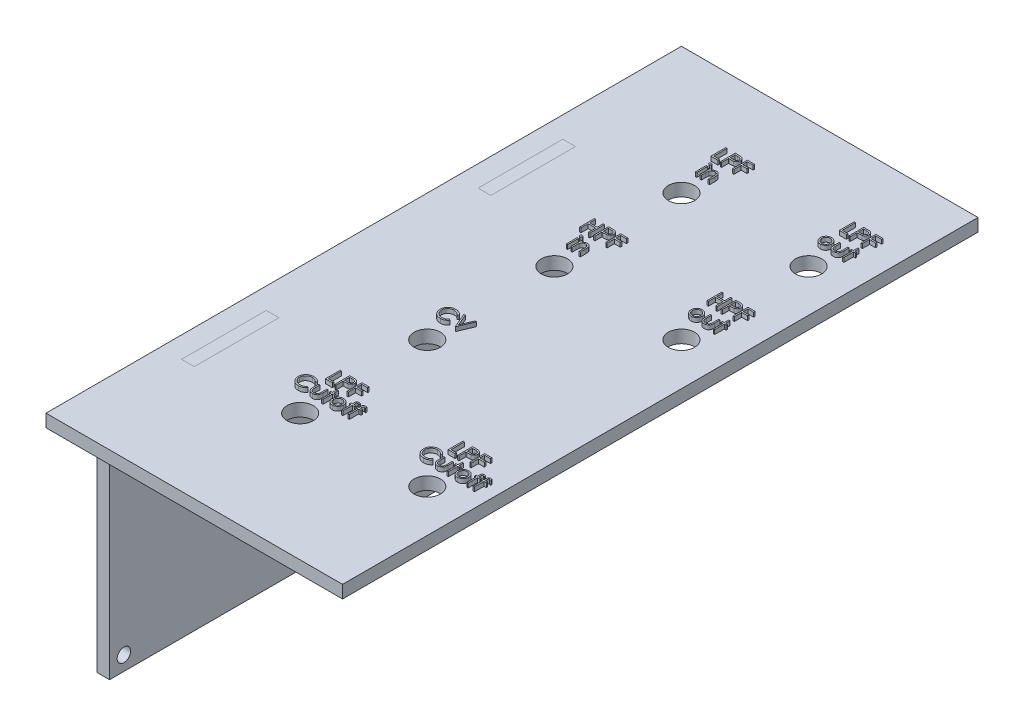
from build123d import *

# Parameters (mm, degrees)
SKETCH1_W           = 70
SKETCH1_H           = 150
SKETCH1_R           = 3.1
SKETCH1_W_2         = 3
SKETCH1_H_2         = 20
BOSS_EXTRUDE1_DEPTH = 3
SKETCH2_R           = 1.6
BOSS_EXTRUDE2_DEPTH = 3
SKETCH3_W           = 0.314102564
SKETCH3_H           = 2.557692308
BOSS_EXTRUDE3_DEPTH = 1


with BuildPart() as part:
    # Sketch1 → Boss-Extrude1 (new body)
    with BuildSketch(Plane(origin=(0, 0, 0), x_dir=(1, 0, 0), z_dir=(0, 1, 0))):
        with Locations((35, -75)):
            Rectangle(SKETCH1_W, SKETCH1_H)
        with Locations(Location((30, -30, 0), (0, 0, 270))):
            Circle(SKETCH1_R, mode=Mode.SUBTRACT)
        with Locations(Location((60, -30, 0), (0, 0, 270))):
            Circle(SKETCH1_R, mode=Mode.SUBTRACT)
        with Locations(Location((60, -60, 0), (0, 0, 270))):
            Circle(SKETCH1_R, mode=Mode.SUBTRACT)
        with Locations(Location((30, -60, 0), (0, 0, 270))):
            Circle(SKETCH1_R, mode=Mode.SUBTRACT)
        with Locations(Location((30, -90, 0), (0, 0, 270))):
            Circle(SKETCH1_R, mode=Mode.SUBTRACT)
        with Locations(Location((30, -120, 0), (0, 0, 270))):
            Circle(SKETCH1_R, mode=Mode.SUBTRACT)
        with Locations(Location((60, -120, 0), (0, 0, 270))):
            Circle(SKETCH1_R, mode=Mode.SUBTRACT)
        with Locations((6.5, -43)):
            Rectangle(SKETCH1_W_2, SKETCH1_H_2, mode=Mode.SUBTRACT)
        with Locations((6.5, -113)):
            Rectangle(SKETCH1_W_2, SKETCH1_H_2, mode=Mode.SUBTRACT)
    extrude(amount=BOSS_EXTRUDE1_DEPTH)

    # Sketch3 → Boss-Extrude3 (add)
    # profile 1 of 44: a face of its own
    with BuildSketch(Plane(origin=(0, 3, 0), x_dir=(1, 0, 0), z_dir=(0, 1, 0))):
        Polygon((26.948717949, -16.5), (27.262820513, -16.5), (27.262820513, -19.641025641), (28.608974359, -19.641025641), (28.608974359, -20), (26.948717949, -20), align=None)
    # profile 2 of 44: a face of its own
    with BuildSketch(Plane(origin=(0, 3, 0), x_dir=(1, 0, 0), z_dir=(0, 1, 0))):
        with BuildLine():
            Line((29.192307692, -16.5), (29.878705929, -16.5))
            add(Edge.make_bspline(
                [(29.878705929, -16.5), (29.925916836, -16.500051896), (30.016375028, -16.500151332), (30.146090084, -16.503166078), (30.263899816, -16.50719277), (30.369550197, -16.512774663), (30.463366295, -16.519371253), (30.544923594, -16.528623292), (30.614863151, -16.538283588), (30.6567696, -16.548104995), (30.67588141, -16.552584135)],
                knots=[0, 0, 0, 0, 1.415646017, 2.712440637, 3.8905458, 4.950247383, 5.884950622, 6.709939814, 7.411656543, 8, 8, 8, 8], degree=3))
            add(Edge.make_bspline(
                [(30.67588141, -16.552584135), (30.700074944, -16.559206084), (30.747891921, -16.572293946), (30.816792964, -16.59850767), (30.88234681, -16.629589835), (30.944778368, -16.665013775), (31.003320451, -16.706299339), (31.058846492, -16.751772957), (31.110866473, -16.802484525), (31.159087864, -16.857865265), (31.203372662, -16.916985475), (31.241502345, -16.980727705), (31.273429572, -17.048019008), (31.300812843, -17.118812579), (31.320521298, -17.193702903), (31.335368198, -17.272169615), (31.344791825, -17.354204305), (31.345694387, -17.410264173), (31.346153846, -17.438802083)],
                knots=[0, 0, 0, 0, 0.999701418, 1.975846123, 2.934577507, 3.890451536, 4.834027766, 5.787354733, 6.749476667, 7.726910423, 8.712836071, 9.690891519, 10.682875813, 11.679750201, 12.712814741, 13.765529915, 14.8625177, 16, 16, 16, 16], degree=3))
            add(Edge.make_bspline(
                [(31.346153846, -17.438802083), (31.345732421, -17.46757986), (31.344907875, -17.523885524), (31.33501159, -17.606258312), (31.321681399, -17.684976702), (31.301184346, -17.759866153), (31.274338673, -17.830481923), (31.24284662, -17.897903155), (31.20486309, -17.960982827), (31.16121826, -18.019949945), (31.112666666, -18.074859857), (31.059413728, -18.125314652), (31.001674435, -18.17101899), (30.939632287, -18.212075334), (30.872682438, -18.247531613), (30.801840285, -18.279288918), (30.726490068, -18.305959979), (30.674347554, -18.31999004), (30.647836538, -18.327123397)],
                knots=[0, 0, 0, 0, 1.121902311, 2.195077645, 3.232258892, 4.234102512, 5.217864754, 6.176164875, 7.132989551, 8.084763148, 9.034132444, 9.988522005, 10.94243251, 11.903244335, 12.886203696, 13.894208494, 14.929344452, 16, 16, 16, 16], degree=3))
            add(Edge.make_bspline(
                [(30.647836538, -18.327123397), (30.625909204, -18.331786379), (30.577854177, -18.342005573), (30.498711455, -18.35341403), (30.406566069, -18.36315163), (30.301543789, -18.370452768), (30.183738884, -18.376703136), (30.053087627, -18.38167123), (29.90933355, -18.384401084), (29.809062306, -18.384541877), (29.756710737, -18.384615385)],
                knots=[0, 0, 0, 0, 0.601384939, 1.31797006, 2.144135048, 3.087295005, 4.142315834, 5.309527816, 6.595305764, 8, 8, 8, 8], degree=3))
            Line((29.756710737, -18.384615385), (29.506410256, -18.384615385))
            Line((29.506410256, -18.384615385), (29.506410256, -20))
            Line((29.506410256, -20), (29.192307692, -20))
            Line((29.192307692, -20), (29.192307692, -16.5))
        make_face()
        with BuildLine():
            Line((29.506410256, -16.858974359), (29.506410256, -18.025641026))
            Line((29.506410256, -18.025641026), (30.119190705, -18.033353365))
            add(Edge.make_bspline(
                [(30.119190705, -18.033353365), (30.149110631, -18.033368829), (30.206870431, -18.033398681), (30.290306654, -18.029413458), (30.367715941, -18.024812925), (30.438860517, -18.018077002), (30.503772451, -18.008555744), (30.56255998, -17.998944006), (30.614767263, -17.985038644), (30.675866465, -17.966315574), (30.743949812, -17.934382959), (30.818017361, -17.888033069), (30.880787947, -17.82895236), (30.935106244, -17.762524529), (30.978212122, -17.6886254), (31.009768114, -17.609556463), (31.028309272, -17.526128613), (31.030795465, -17.469040475), (31.032051282, -17.440204327)],
                knots=[0, 0, 0, 0, 1.160613943, 2.240541288, 3.23993089, 4.169200891, 5.011653406, 5.7853311, 6.478053781, 7.106038997, 8.262395093, 9.384106736, 10.481365981, 11.59014053, 12.70357646, 13.786202915, 14.881775077, 16, 16, 16, 16], degree=3))
            add(Edge.make_bspline(
                [(31.032051282, -17.440204327), (31.030788636, -17.412065813), (31.028278651, -17.356129931), (31.009622787, -17.274151171), (30.978273474, -17.195915466), (30.934816879, -17.122942381), (30.882075749, -17.056753577), (30.820776406, -16.99925645), (30.751063145, -16.953034747), (30.686214914, -16.923201466), (30.628613728, -16.90498619), (30.578581768, -16.89224135), (30.522091093, -16.882065743), (30.459123314, -16.873826241), (30.39016648, -16.866772779), (30.314628165, -16.861986802), (30.232794522, -16.859185346), (30.175983951, -16.859046391), (30.146534455, -16.858974359)],
                knots=[0, 0, 0, 0, 1.120700087, 2.227813068, 3.331159281, 4.466773991, 5.599788987, 6.693661531, 7.80175334, 8.91857717, 9.525282508, 10.207424825, 10.974604443, 11.810962634, 12.737642355, 13.736264703, 14.826523623, 16, 16, 16, 16], degree=3))
            Line((30.146534455, -16.858974359), (29.506410256, -16.858974359))
        make_face(mode=Mode.SUBTRACT)
    # profile 3 of 44: a face of its own
    with BuildSketch(Plane(origin=(0, 3, 0), x_dir=(1, 0, 0), z_dir=(0, 1, 0))):
        Polygon((32.064102564, -16.5), (33.769230769, -16.5), (33.769230769, -16.858974359), (32.378205128, -16.858974359), (32.378205128, -17.935897436), (33.769230769, -17.935897436), (33.769230769, -18.294871795), (32.378205128, -18.294871795), (32.378205128, -20), (32.064102564, -20), align=None)
    # profile 4 of 44: a face of its own
    with BuildSketch(Plane(origin=(0, 3, 0), x_dir=(1, 0, 0), z_dir=(0, 1, 0))):
        Polygon((57.282051282, -16.5), (57.596153846, -16.5), (57.596153846, -19.641025641), (58.942307692, -19.641025641), (58.942307692, -20), (57.282051282, -20), align=None)
    # profile 5 of 44: a face of its own
    with BuildSketch(Plane(origin=(0, 3, 0), x_dir=(1, 0, 0), z_dir=(0, 1, 0))):
        with BuildLine():
            Line((59.525641026, -16.5), (60.212039263, -16.5))
            add(Edge.make_bspline(
                [(60.212039263, -16.5), (60.259250169, -16.500051896), (60.349708362, -16.500151332), (60.479423417, -16.503166078), (60.597233149, -16.50719277), (60.70288353, -16.512774663), (60.796699628, -16.519371253), (60.878256928, -16.528623292), (60.948196484, -16.538283588), (60.990102933, -16.548104995), (61.009214744, -16.552584135)],
                knots=[0, 0, 0, 0, 1.415646017, 2.712440637, 3.8905458, 4.950247383, 5.884950622, 6.709939814, 7.411656543, 8, 8, 8, 8], degree=3))
            add(Edge.make_bspline(
                [(61.009214744, -16.552584135), (61.033408277, -16.559206084), (61.081225255, -16.572293946), (61.150126298, -16.59850767), (61.215680143, -16.629589835), (61.278111702, -16.665013775), (61.336653785, -16.706299339), (61.392179826, -16.751772957), (61.444199806, -16.802484525), (61.492421198, -16.857865265), (61.536705995, -16.916985475), (61.574835678, -16.980727705), (61.606762905, -17.048019008), (61.634146177, -17.118812579), (61.653854631, -17.193702903), (61.668701531, -17.272169615), (61.678125158, -17.354204305), (61.67902772, -17.410264173), (61.679487179, -17.438802083)],
                knots=[0, 0, 0, 0, 0.999701418, 1.975846123, 2.934577507, 3.890451536, 4.834027766, 5.787354733, 6.749476667, 7.726910423, 8.712836071, 9.690891519, 10.682875813, 11.679750201, 12.712814741, 13.765529915, 14.8625177, 16, 16, 16, 16], degree=3))
            add(Edge.make_bspline(
                [(61.679487179, -17.438802083), (61.679065755, -17.46757986), (61.678241209, -17.523885524), (61.668344923, -17.606258312), (61.655014732, -17.684976702), (61.63451768, -17.759866153), (61.607672006, -17.830481923), (61.576179954, -17.897903155), (61.538196423, -17.960982827), (61.494551594, -18.019949945), (61.445999999, -18.074859857), (61.392747061, -18.125314652), (61.335007768, -18.17101899), (61.27296562, -18.212075334), (61.206015772, -18.247531613), (61.135173618, -18.279288918), (61.059823402, -18.305959979), (61.007680888, -18.31999004), (60.981169872, -18.327123397)],
                knots=[0, 0, 0, 0, 1.121902311, 2.195077645, 3.232258892, 4.234102512, 5.217864754, 6.176164875, 7.132989551, 8.084763148, 9.034132444, 9.988522005, 10.94243251, 11.903244335, 12.886203696, 13.894208494, 14.929344452, 16, 16, 16, 16], degree=3))
            add(Edge.make_bspline(
                [(60.981169872, -18.327123397), (60.959242538, -18.331786379), (60.91118751, -18.342005573), (60.832044788, -18.35341403), (60.739899402, -18.36315163), (60.634877122, -18.370452768), (60.517072217, -18.376703136), (60.38642096, -18.38167123), (60.242666883, -18.384401084), (60.142395639, -18.384541877), (60.090044071, -18.384615385)],
                knots=[0, 0, 0, 0, 0.601384939, 1.31797006, 2.144135048, 3.087295005, 4.142315834, 5.309527816, 6.595305764, 8, 8, 8, 8], degree=3))
            Line((60.090044071, -18.384615385), (59.83974359, -18.384615385))
            Line((59.83974359, -18.384615385), (59.83974359, -20))
            Line((59.83974359, -20), (59.525641026, -20))
            Line((59.525641026, -20), (59.525641026, -16.5))
        make_face()
        with BuildLine():
            Line((59.83974359, -16.858974359), (59.83974359, -18.025641026))
            Line((59.83974359, -18.025641026), (60.452524038, -18.033353365))
            add(Edge.make_bspline(
                [(60.452524038, -18.033353365), (60.482443964, -18.033368829), (60.540203764, -18.033398681), (60.623639987, -18.029413458), (60.701049275, -18.024812925), (60.77219385, -18.018077002), (60.837105785, -18.008555744), (60.895893313, -17.998944006), (60.948100596, -17.985038644), (61.009199798, -17.966315574), (61.077283146, -17.934382959), (61.151350694, -17.888033069), (61.21412128, -17.82895236), (61.268439577, -17.762524529), (61.311545455, -17.6886254), (61.343101448, -17.609556463), (61.361642605, -17.526128613), (61.364128799, -17.469040475), (61.365384615, -17.440204327)],
                knots=[0, 0, 0, 0, 1.160613943, 2.240541288, 3.23993089, 4.169200891, 5.011653406, 5.7853311, 6.478053781, 7.106038997, 8.262395093, 9.384106736, 10.481365981, 11.59014053, 12.70357646, 13.786202915, 14.881775077, 16, 16, 16, 16], degree=3))
            add(Edge.make_bspline(
                [(61.365384615, -17.440204327), (61.364121969, -17.412065813), (61.361611984, -17.356129931), (61.342956121, -17.274151171), (61.311606807, -17.195915466), (61.268150212, -17.122942381), (61.215409082, -17.056753577), (61.154109739, -16.99925645), (61.084396478, -16.953034747), (61.019548247, -16.923201466), (60.961947061, -16.90498619), (60.911915101, -16.89224135), (60.855424427, -16.882065743), (60.792456647, -16.873826241), (60.723499813, -16.866772779), (60.647961498, -16.861986802), (60.566127855, -16.859185346), (60.509317284, -16.859046391), (60.479867788, -16.858974359)],
                knots=[0, 0, 0, 0, 1.120700087, 2.227813068, 3.331159281, 4.466773991, 5.599788987, 6.693661531, 7.80175334, 8.91857717, 9.525282508, 10.207424825, 10.974604443, 11.810962634, 12.737642355, 13.736264703, 14.826523623, 16, 16, 16, 16], degree=3))
            Line((60.479867788, -16.858974359), (59.83974359, -16.858974359))
        make_face(mode=Mode.SUBTRACT)
    # profile 6 of 44: a face of its own
    with BuildSketch(Plane(origin=(0, 3, 0), x_dir=(1, 0, 0), z_dir=(0, 1, 0))):
        Polygon((62.397435897, -16.5), (64.102564103, -16.5), (64.102564103, -16.858974359), (62.711538462, -16.858974359), (62.711538462, -17.935897436), (64.102564103, -17.935897436), (64.102564103, -18.294871795), (62.711538462, -18.294871795), (62.711538462, -20), (62.397435897, -20), align=None)
    # profile 7 of 44: a face of its own
    with BuildSketch(Plane(origin=(0, 3, 0), x_dir=(1, 0, 0), z_dir=(0, 1, 0))):
        with BuildLine():
            add(Edge.make_bspline(
                [(28.469751603, -21.365384615), (28.489242918, -21.366288768), (28.527410658, -21.368059272), (28.582603926, -21.383220749), (28.632860938, -21.408920434), (28.677438671, -21.443400115), (28.715690558, -21.483949559), (28.742471268, -21.531210527), (28.759683664, -21.582269166), (28.761762219, -21.617884255), (28.762820513, -21.636017628)],
                knots=[0, 0, 0, 0, 1.055194115, 2.066272739, 3.074728998, 4.095836921, 5.109056067, 6.073838105, 7.019297344, 8, 8, 8, 8], degree=3))
            add(Edge.make_bspline(
                [(28.762820513, -21.636017628), (28.761738353, -21.653680281), (28.759599051, -21.688597256), (28.742484563, -21.738770728), (28.715462325, -21.785375012), (28.677463199, -21.825845722), (28.632854438, -21.860306342), (28.582605653, -21.886011081), (28.527410204, -21.901171218), (28.489242765, -21.902941907), (28.469751603, -21.903846154)],
                knots=[0, 0, 0, 0, 0.96129708, 1.900370562, 2.859976407, 3.87933698, 4.906634145, 5.921202961, 6.938410037, 8, 8, 8, 8], degree=3))
            add(Edge.make_bspline(
                [(28.469751603, -21.903846154), (28.450483327, -21.902976434), (28.412980147, -21.901283637), (28.358613305, -21.885713619), (28.308784816, -21.860297546), (28.264120143, -21.826071361), (28.22688995, -21.785126464), (28.199791624, -21.73879917), (28.182716662, -21.688590015), (28.180572034, -21.653677849), (28.179487179, -21.636017628)],
                knots=[0, 0, 0, 0, 1.054934014, 2.053291228, 3.073705704, 4.106921865, 5.123545215, 6.088680038, 7.033164197, 8, 8, 8, 8], degree=3))
            add(Edge.make_bspline(
                [(28.179487179, -21.636017628), (28.180548266, -21.617886779), (28.182632307, -21.582276646), (28.199804423, -21.531181613), (28.226664231, -21.484200111), (28.264144795, -21.443174612), (28.308778255, -21.408929177), (28.358615, -21.383518196), (28.412979699, -21.367946856), (28.450483175, -21.366254242), (28.469751603, -21.365384615)],
                knots=[0, 0, 0, 0, 0.98631895, 1.937192651, 2.907499808, 3.917963147, 4.944918757, 5.95915025, 6.951458133, 8, 8, 8, 8], degree=3))
        make_face()
    # profile 8 of 44: a face of its own
    with BuildSketch(Plane(origin=(0, 3, 0), x_dir=(1, 0, 0), z_dir=(0, 1, 0))):
        with Locations((28.471153846, -23.721153846)):
            Rectangle(SKETCH3_W, SKETCH3_H)
    # profile 9 of 44: a face of its own
    with BuildSketch(Plane(origin=(0, 3, 0), x_dir=(1, 0, 0), z_dir=(0, 1, 0))):
        with BuildLine():
            Line((29.391025641, -22.442307692), (29.705128205, -22.442307692))
            Line((29.705128205, -22.442307692), (29.705128205, -22.903645833))
            add(Edge.make_bspline(
                [(29.705128205, -22.903645833), (29.73866584, -22.86180311), (29.803746791, -22.780605847), (29.912131125, -22.673885272), (30.026675025, -22.585940047), (30.146677028, -22.515836253), (30.272300038, -22.462989627), (30.402778308, -22.424823696), (30.538893015, -22.401938868), (30.631457451, -22.398948637), (30.678285256, -22.397435897)],
                knots=[0, 0, 0, 0, 1.12780773, 2.188550248, 3.19190651, 4.159438251, 5.104880172, 6.052711206, 7.014878035, 8, 8, 8, 8], degree=3))
            add(Edge.make_bspline(
                [(30.678285256, -22.397435897), (30.725615891, -22.399181093), (30.818253358, -22.402596861), (30.95313142, -22.429613552), (31.079104813, -22.475758808), (31.195724369, -22.538970878), (31.300851583, -22.617577351), (31.393176434, -22.709155133), (31.469539681, -22.814491216), (31.520737044, -22.912214373), (31.554462692, -22.998903167), (31.57569503, -23.073149917), (31.593726011, -23.155868068), (31.609357759, -23.246807657), (31.619934871, -23.346605847), (31.628277162, -23.454853539), (31.634255857, -23.57151567), (31.634493064, -23.652202297), (31.634615385, -23.693810096)],
                knots=[0, 0, 0, 0, 1.235846778, 2.418850247, 3.575807741, 4.728682307, 5.871620074, 6.994088408, 8.11269785, 9.256955736, 9.865816715, 10.540099792, 11.271859618, 12.076849838, 12.949306005, 13.892391288, 14.913166135, 16, 16, 16, 16], degree=3))
            Line((31.634615385, -23.693810096), (31.634615385, -25))
            Line((31.634615385, -25), (31.320512821, -25))
            Line((31.320512821, -25), (31.320512821, -23.796875))
            add(Edge.make_bspline(
                [(31.320512821, -23.796875), (31.320319612, -23.762052555), (31.319950038, -23.695443144), (31.318784392, -23.600074121), (31.315974585, -23.513587543), (31.312026272, -23.436190175), (31.306247242, -23.367956339), (31.30022461, -23.308747062), (31.292859634, -23.25863752), (31.28629672, -23.228472437), (31.283353365, -23.21494391)],
                knots=[0, 0, 0, 0, 1.430800155, 2.736877192, 3.918605307, 4.986035426, 5.920637409, 6.731861385, 7.431261377, 8, 8, 8, 8], degree=3))
            add(Edge.make_bspline(
                [(31.283353365, -23.21494391), (31.272727834, -23.175232725), (31.252276973, -23.098800981), (31.20174299, -22.995126628), (31.137928809, -22.90692844), (31.06003096, -22.834751719), (30.968801884, -22.778580882), (30.864494742, -22.739606927), (30.748116101, -22.715230658), (30.666261718, -22.712803526), (30.623597756, -22.711538462)],
                knots=[0, 0, 0, 0, 1.084156227, 2.086665306, 3.027808233, 3.945421172, 4.874247719, 5.839848303, 6.874090471, 8, 8, 8, 8], degree=3))
            add(Edge.make_bspline(
                [(30.623597756, -22.711538462), (30.598330073, -22.712014466), (30.54832598, -22.712956467), (30.474176008, -22.722407765), (30.402251835, -22.737866221), (30.331831626, -22.758734858), (30.264323832, -22.787397127), (30.197559541, -22.819926498), (30.134052777, -22.86047471), (30.07244938, -22.905665331), (30.015136572, -22.955744538), (29.961808233, -23.008589048), (29.914270213, -23.064864652), (29.871201538, -23.1236646), (29.834023275, -23.185796438), (29.801570187, -23.250660744), (29.774034492, -23.318342893), (29.760351799, -23.365317954), (29.753505609, -23.388822115)],
                knots=[0, 0, 0, 0, 1.023777757, 2.026029729, 3.023749952, 4.003683103, 4.997618607, 5.993177895, 7.010360494, 8.046726602, 9.087585522, 10.09234134, 11.086953743, 12.070360549, 13.043493632, 14.017870808, 15.008233677, 16, 16, 16, 16], degree=3))
            add(Edge.make_bspline(
                [(29.753505609, -23.388822115), (29.74956596, -23.406077318), (29.740989552, -23.443640993), (29.731726372, -23.505285412), (29.723318796, -23.576595387), (29.716281838, -23.657487704), (29.711976421, -23.748245579), (29.707282024, -23.848481417), (29.705572963, -23.958594906), (29.705280609, -24.035256598), (29.705128205, -24.075220353)],
                knots=[0, 0, 0, 0, 0.615963638, 1.340920617, 2.168419149, 3.115676021, 4.16674242, 5.331190069, 6.6087489, 8, 8, 8, 8], degree=3))
            Line((29.705128205, -24.075220353), (29.705128205, -25))
            Line((29.705128205, -25), (29.391025641, -25))
            Line((29.391025641, -25), (29.391025641, -22.442307692))
        make_face()
    # profile 10 of 44: a face of its own
    with BuildSketch(Plane(origin=(0, 3, 0), x_dir=(1, 0, 0), z_dir=(0, 1, 0))):
        with BuildLine():
            add(Edge.make_bspline(
                [(57.818709936, -22.397435897), (57.866701209, -22.398457789), (57.960800366, -22.400461467), (58.098608252, -22.421876433), (58.230153388, -22.454623797), (58.35593958, -22.499895359), (58.474355876, -22.56057731), (58.58712712, -22.632986601), (58.693944129, -22.718769195), (58.757967158, -22.785127263), (58.790464744, -22.818810096)],
                knots=[0, 0, 0, 0, 1.054011418, 2.066658804, 3.057071809, 4.030435133, 4.997543892, 5.974964718, 6.972108034, 8, 8, 8, 8], degree=3))
            add(Edge.make_bspline(
                [(58.790464744, -22.818810096), (58.818446698, -22.851024082), (58.873869078, -22.914828624), (58.944934797, -23.018284237), (59.006156357, -23.125424338), (59.055219318, -23.237671664), (59.093904342, -23.354046336), (59.121370038, -23.474948347), (59.137706973, -23.600110694), (59.13990994, -23.685114532), (59.141025641, -23.728165064)],
                knots=[0, 0, 0, 0, 1.025258237, 2.030674902, 3.01204498, 3.988269485, 4.97094183, 5.956517959, 6.965070386, 8, 8, 8, 8], degree=3))
            add(Edge.make_bspline(
                [(59.141025641, -23.728165064), (59.140044304, -23.771465122), (59.138105135, -23.857028055), (59.119761519, -23.983047421), (59.091230433, -24.105242244), (59.050398595, -24.223100937), (58.998040486, -24.336983765), (58.934149798, -24.446393314), (58.858278181, -24.551545447), (58.772274184, -24.651547286), (58.677222308, -24.7437135), (58.57410616, -24.82404177), (58.464952126, -24.892863294), (58.348308773, -24.94829971), (58.225241286, -24.99200941), (58.095484218, -25.022709427), (57.959239148, -25.04127111), (57.866211926, -25.043654684), (57.818709936, -25.044871795)],
                knots=[0, 0, 0, 0, 0.998656419, 1.973391657, 2.932242238, 3.890759089, 4.846373663, 5.82037756, 6.809684879, 7.83454468, 8.860553229, 9.859544525, 10.845671541, 11.83227036, 12.833544569, 13.85385346, 14.904124723, 16, 16, 16, 16], degree=3))
            add(Edge.make_bspline(
                [(57.818709936, -25.044871795), (57.770975216, -25.043650599), (57.677484357, -25.041258824), (57.540758375, -25.022781541), (57.410768756, -24.992023559), (57.287540157, -24.948156066), (57.17039531, -24.892861522), (57.060608813, -24.824249833), (56.957408898, -24.743689678), (56.862336913, -24.651553741), (56.776338308, -24.551543784), (56.7004653, -24.446393746), (56.636574974, -24.336983652), (56.58421677, -24.223100967), (56.543384957, -24.105242236), (56.514853864, -23.983047423), (56.49651025, -23.857028055), (56.494571081, -23.771465122), (56.493589744, -23.728165064)],
                knots=[0, 0, 0, 0, 1.099876186, 2.154163076, 3.173186993, 4.173200201, 5.163417411, 6.152872554, 7.150605724, 8.17532212, 9.198891216, 10.186952605, 11.159729845, 12.11414092, 13.071450619, 14.029093627, 15.002601286, 16, 16, 16, 16], degree=3))
            add(Edge.make_bspline(
                [(56.493589744, -23.728165064), (56.494713054, -23.685348518), (56.496937015, -23.600579116), (56.513257524, -23.475652055), (56.540616081, -23.354954666), (56.579347477, -23.23902919), (56.628862668, -23.127273754), (56.689223956, -23.019868923), (56.761014589, -22.916881123), (56.81621654, -22.853159043), (56.844150641, -22.820913462)],
                knots=[0, 0, 0, 0, 1.031353054, 2.041901799, 3.029428768, 4.008703097, 4.981709435, 5.96992636, 6.972712378, 8, 8, 8, 8], degree=3))
            add(Edge.make_bspline(
                [(56.844150641, -22.820913462), (56.876599232, -22.786938522), (56.940415096, -22.720120826), (57.047763824, -22.634588302), (57.160257645, -22.560672228), (57.279982571, -22.501196013), (57.405665429, -22.454357495), (57.537884671, -22.42179198), (57.676160187, -22.400538625), (57.770719808, -22.398480447), (57.818709936, -22.397435897)],
                knots=[0, 0, 0, 0, 1.027980169, 2.021703884, 2.998553061, 3.971491411, 4.943284454, 5.930300938, 6.949603206, 8, 8, 8, 8], degree=3))
        make_face()
        with BuildLine():
            add(Edge.make_bspline(
                [(57.817307692, -22.711538462), (57.783370081, -22.712503053), (57.716370952, -22.714407336), (57.617751368, -22.72889124), (57.522811214, -22.751838745), (57.43137037, -22.784442801), (57.343737197, -22.8265417), (57.259827795, -22.87825006), (57.179395355, -22.938883016), (57.104013291, -23.008345688), (57.034830979, -23.084224683), (56.974353003, -23.165073041), (56.922927896, -23.249579388), (56.880087737, -23.337831599), (56.848180549, -23.430724013), (56.825007527, -23.527204644), (56.810537286, -23.62747006), (56.808650908, -23.695631079), (56.807692308, -23.730268429)],
                knots=[0, 0, 0, 0, 1.021534396, 2.016698045, 2.994645724, 3.958388632, 4.93408049, 5.916473867, 6.921342795, 7.962252576, 8.998418191, 10.008913653, 10.997312074, 11.973003931, 12.956656626, 13.948281152, 14.957379055, 16, 16, 16, 16], degree=3))
            add(Edge.make_bspline(
                [(56.807692308, -23.730268429), (56.809299131, -23.775020457), (56.812488376, -23.863844862), (56.838423612, -23.994655985), (56.881809892, -24.120237837), (56.940397172, -24.239854223), (57.01380339, -24.350526501), (57.100290457, -24.449197985), (57.198930158, -24.534383797), (57.308546658, -24.605064642), (57.426900976, -24.661224398), (57.552157297, -24.701023374), (57.682797991, -24.726895066), (57.772078722, -24.729466541), (57.817307692, -24.730769231)],
                knots=[0, 0, 0, 0, 1.016792936, 2.018143844, 3.017858371, 4.030088057, 5.03801393, 6.028138512, 7.003788237, 7.991172063, 8.984598303, 9.972568034, 10.972917682, 12, 12, 12, 12], degree=3))
            add(Edge.make_bspline(
                [(57.817307692, -24.730769231), (57.862534061, -24.729458951), (57.951809657, -24.726872494), (58.082268834, -24.701153674), (58.207182806, -24.661050013), (58.325414193, -24.605127803), (58.434980797, -24.534115389), (58.534329918, -24.449679012), (58.620078529, -24.35026516), (58.693412134, -24.239707631), (58.752958877, -24.120423279), (58.796142079, -23.994632807), (58.822139665, -23.863850765), (58.825320493, -23.775022434), (58.826923077, -23.730268429)],
                knots=[0, 0, 0, 0, 1.02726834, 2.027799167, 3.010890988, 4.004497153, 4.992059811, 5.971914811, 6.958719428, 7.966827853, 8.981595046, 9.981490638, 10.983022906, 12, 12, 12, 12], degree=3))
            add(Edge.make_bspline(
                [(58.826923077, -23.730268429), (58.825964807, -23.695630872), (58.824079078, -23.627469446), (58.809604113, -23.527206993), (58.786448574, -23.430715396), (58.754476956, -23.337863393), (58.711822943, -23.249350888), (58.65940615, -23.165321161), (58.599175124, -23.083944615), (58.529158003, -23.008590974), (58.453854625, -22.938855938), (58.373389587, -22.878226548), (58.289604609, -22.826768953), (58.202226026, -22.784082712), (58.110773458, -22.752135372), (58.015966329, -22.728758741), (57.917767519, -22.714468544), (57.851008476, -22.712521402), (57.817307692, -22.711538462)],
                knots=[0, 0, 0, 0, 1.042956736, 2.052379634, 3.044323526, 4.02829302, 5.004299113, 5.996692471, 7.007513377, 8.048758398, 9.090003419, 10.095195979, 11.07790575, 12.047570684, 13.018257071, 13.989683339, 14.985167495, 16, 16, 16, 16], degree=3))
        make_face(mode=Mode.SUBTRACT)
    # profile 11 of 44: a face of its own
    with BuildSketch(Plane(origin=(0, 3, 0), x_dir=(1, 0, 0), z_dir=(0, 1, 0))):
        with BuildLine():
            Line((59.724358974, -22.442307692), (60.038461538, -22.442307692))
            Line((60.038461538, -22.442307692), (60.038461538, -23.628605769))
            add(Edge.make_bspline(
                [(60.038461538, -23.628605769), (60.038603443, -23.663428518), (60.038874901, -23.730042806), (60.040715842, -23.825897993), (60.045045935, -23.913314706), (60.05045976, -23.992343443), (60.057421896, -24.062970834), (60.065705256, -24.124950191), (60.074963678, -24.178984375), (60.084026392, -24.211527731), (60.088241186, -24.22666266)],
                knots=[0, 0, 0, 0, 1.388932606, 2.656963016, 3.823490214, 4.879454478, 5.816252168, 6.653371382, 7.373723809, 8, 8, 8, 8], degree=3))
            add(Edge.make_bspline(
                [(60.088241186, -24.22666266), (60.095002641, -24.245685531), (60.108384982, -24.283335792), (60.132658466, -24.337724798), (60.162686802, -24.38810008), (60.19554663, -24.436404153), (60.233446038, -24.48120614), (60.275905509, -24.522430383), (60.321503746, -24.561634474), (60.389258769, -24.608019266), (60.481918035, -24.657734597), (60.603570791, -24.700630415), (60.735475016, -24.726266235), (60.826639736, -24.72924049), (60.873497596, -24.730769231)],
                knots=[0, 0, 0, 0, 0.725840625, 1.436591201, 2.137033971, 2.831655856, 3.53531722, 4.242432219, 4.957935707, 5.694543706, 7.190802206, 8.724350549, 10.316345118, 12, 12, 12, 12], degree=3))
            add(Edge.make_bspline(
                [(60.873497596, -24.730769231), (60.920351104, -24.729207982), (61.011003972, -24.726187255), (61.141458941, -24.701403716), (61.260710356, -24.659998027), (61.367561307, -24.602190616), (61.461527147, -24.531448553), (61.539831566, -24.448439744), (61.604438821, -24.355790357), (61.632648241, -24.286666078), (61.646834936, -24.251903045)],
                knots=[0, 0, 0, 0, 1.157059328, 2.238695713, 3.266970494, 4.264342957, 5.228770407, 6.160125903, 7.074715775, 8, 8, 8, 8], degree=3))
            add(Edge.make_bspline(
                [(61.646834936, -24.251903045), (61.651029166, -24.237936746), (61.660301584, -24.207060671), (61.670263936, -24.154680922), (61.679238397, -24.092216318), (61.686901574, -24.019258109), (61.692366736, -23.935996957), (61.695312763, -23.842458881), (61.698641038, -23.73893752), (61.698691554, -23.666469761), (61.698717949, -23.628605769)],
                knots=[0, 0, 0, 0, 0.557542046, 1.232589297, 2.036731608, 2.971723315, 4.038036528, 5.22795436, 6.551621927, 8, 8, 8, 8], degree=3))
            Line((61.698717949, -23.628605769), (61.698717949, -22.442307692))
            Line((61.698717949, -22.442307692), (62.012820513, -22.442307692))
            Line((62.012820513, -22.442307692), (62.012820513, -23.6875))
            add(Edge.make_bspline(
                [(62.012820513, -23.6875), (62.012378818, -23.729807171), (62.01152187, -23.811888871), (62.006014526, -23.931172983), (61.996564913, -24.042335228), (61.982222229, -24.145434448), (61.965356554, -24.240391929), (61.943600281, -24.327329375), (61.917622043, -24.405978929), (61.888316528, -24.477720706), (61.853694661, -24.5427676), (61.81686764, -24.604503417), (61.774342868, -24.661396352), (61.729572634, -24.716278489), (61.679770978, -24.766420017), (61.625871119, -24.812971493), (61.568631699, -24.856644524), (61.506782501, -24.895735804), (61.441226438, -24.930952449), (61.371882581, -24.962168527), (61.297901583, -24.986871104), (61.220237946, -25.00818177), (61.138511167, -25.024896239), (61.052800034, -25.036682806), (60.963133418, -25.043908137), (60.902023958, -25.044545182), (60.870693109, -25.044871795)],
                knots=[0, 0, 0, 0, 1.493040784, 2.896703357, 4.213163133, 5.428574705, 6.569057535, 7.615249723, 8.588095153, 9.490268104, 10.346124644, 11.18633936, 12.024365274, 12.850166724, 13.684164916, 14.514361689, 15.362232829, 16.222528818, 17.093394965, 17.986930858, 18.902426812, 19.842810585, 20.827885679, 21.843828298, 22.894529745, 24, 24, 24, 24], degree=3))
            add(Edge.make_bspline(
                [(60.870693109, -25.044871795), (60.839596595, -25.044532088), (60.77848905, -25.043864532), (60.688817806, -25.036722724), (60.602869199, -25.024914553), (60.520948801, -25.008059336), (60.442974403, -24.987020266), (60.368630164, -24.96201673), (60.298786601, -24.930936249), (60.232604597, -24.895958691), (60.170602208, -24.856393416), (60.11249363, -24.813025376), (60.058356778, -24.765919313), (60.00817971, -24.715271956), (59.962666733, -24.66045502), (59.921250691, -24.601909459), (59.883293986, -24.540215371), (59.848941196, -24.474152208), (59.81942944, -24.401580198), (59.793374194, -24.321283101), (59.772063556, -24.232380585), (59.754721088, -24.134948656), (59.740769647, -24.029453615), (59.731083505, -23.915285199), (59.725667674, -23.792721507), (59.724804613, -23.708071617), (59.724358974, -23.664362981)],
                knots=[0, 0, 0, 0, 1.083640291, 2.129454052, 3.13281866, 4.105697902, 5.042300162, 5.946461698, 6.836384745, 7.703652036, 8.553297018, 9.397182691, 10.228592656, 11.052265423, 11.879314572, 12.708807002, 13.549817954, 14.402308542, 15.300838682, 16.27712199, 17.341985831, 18.484375296, 19.725102775, 21.0496083, 22.476576903, 24, 24, 24, 24], degree=3))
            Line((59.724358974, -23.664362981), (59.724358974, -22.442307692))
        make_face()
    # profile 12 of 44: a face of its own
    with BuildSketch(Plane(origin=(0, 3, 0), x_dir=(1, 0, 0), z_dir=(0, 1, 0))):
        Polygon((63.044871795, -21.41025641), (63.358974359, -21.41025641), (63.358974359, -22.442307692), (63.807692308, -22.442307692), (63.807692308, -22.756410256), (63.358974359, -22.756410256), (63.358974359, -25), (63.044871795, -25), (63.044871795, -22.756410256), (62.596153846, -22.756410256), (62.596153846, -22.442307692), (63.044871795, -22.442307692), align=None)
    # profile 13 of 44: a face of its own
    with BuildSketch(Plane(origin=(0, 3, 0), x_dir=(1, 0, 0), z_dir=(0, 1, 0))):
        Polygon((25.948717949, -46.5), (26.262820513, -46.5), (26.262820513, -47.935897436), (28.057692308, -47.935897436), (28.057692308, -46.5), (28.371794872, -46.5), (28.371794872, -50), (28.057692308, -50), (28.057692308, -48.294871795), (26.262820513, -48.294871795), (26.262820513, -50), (25.948717949, -50), align=None)
    # profile 14 of 44: a face of its own
    with BuildSketch(Plane(origin=(0, 3, 0), x_dir=(1, 0, 0), z_dir=(0, 1, 0))):
        with BuildLine():
            Line((29.269230769, -46.5), (29.955629006, -46.5))
            add(Edge.make_bspline(
                [(29.955629006, -46.5), (30.002839913, -46.500051896), (30.093298105, -46.500151332), (30.223013161, -46.503166078), (30.340822893, -46.50719277), (30.446473274, -46.512774663), (30.540289372, -46.519371253), (30.621846671, -46.528623292), (30.691786228, -46.538283588), (30.733692677, -46.548104995), (30.752804487, -46.552584135)],
                knots=[0, 0, 0, 0, 1.415646017, 2.712440637, 3.8905458, 4.950247383, 5.884950622, 6.709939814, 7.411656543, 8, 8, 8, 8], degree=3))
            add(Edge.make_bspline(
                [(30.752804487, -46.552584135), (30.776998021, -46.559206084), (30.824814998, -46.572293946), (30.893716041, -46.59850767), (30.959269887, -46.629589835), (31.021701445, -46.665013775), (31.080243528, -46.706299339), (31.135769569, -46.751772957), (31.18778955, -46.802484525), (31.236010941, -46.857865265), (31.280295739, -46.916985475), (31.318425422, -46.980727705), (31.350352649, -47.048019008), (31.37773592, -47.118812579), (31.397444375, -47.193702903), (31.412291274, -47.272169615), (31.421714902, -47.354204305), (31.422617464, -47.410264173), (31.423076923, -47.438802083)],
                knots=[0, 0, 0, 0, 0.999701418, 1.975846123, 2.934577507, 3.890451536, 4.834027766, 5.787354733, 6.749476667, 7.726910423, 8.712836071, 9.690891519, 10.682875813, 11.679750201, 12.712814741, 13.765529915, 14.8625177, 16, 16, 16, 16], degree=3))
            add(Edge.make_bspline(
                [(31.423076923, -47.438802083), (31.422655498, -47.46757986), (31.421830952, -47.523885524), (31.411934667, -47.606258312), (31.398604475, -47.684976702), (31.378107423, -47.759866153), (31.35126175, -47.830481923), (31.319769697, -47.897903155), (31.281786167, -47.960982827), (31.238141337, -48.019949945), (31.189589743, -48.074859857), (31.136336805, -48.125314652), (31.078597512, -48.17101899), (31.016555364, -48.212075334), (30.949605515, -48.247531613), (30.878763362, -48.279288918), (30.803413145, -48.305959979), (30.751270631, -48.31999004), (30.724759615, -48.327123397)],
                knots=[0, 0, 0, 0, 1.121902311, 2.195077645, 3.232258892, 4.234102512, 5.217864754, 6.176164875, 7.132989551, 8.084763148, 9.034132444, 9.988522005, 10.94243251, 11.903244335, 12.886203696, 13.894208494, 14.929344452, 16, 16, 16, 16], degree=3))
            add(Edge.make_bspline(
                [(30.724759615, -48.327123397), (30.702832281, -48.331786379), (30.654777254, -48.342005573), (30.575634532, -48.35341403), (30.483489146, -48.36315163), (30.378466866, -48.370452768), (30.260661961, -48.376703136), (30.130010704, -48.38167123), (29.986256627, -48.384401084), (29.885985383, -48.384541877), (29.833633814, -48.384615385)],
                knots=[0, 0, 0, 0, 0.601384939, 1.31797006, 2.144135048, 3.087295005, 4.142315834, 5.309527816, 6.595305764, 8, 8, 8, 8], degree=3))
            Line((29.833633814, -48.384615385), (29.583333333, -48.384615385))
            Line((29.583333333, -48.384615385), (29.583333333, -50))
            Line((29.583333333, -50), (29.269230769, -50))
            Line((29.269230769, -50), (29.269230769, -46.5))
        make_face()
        with BuildLine():
            Line((29.583333333, -46.858974359), (29.583333333, -48.025641026))
            Line((29.583333333, -48.025641026), (30.196113782, -48.033353365))
            add(Edge.make_bspline(
                [(30.196113782, -48.033353365), (30.226033708, -48.033368829), (30.283793508, -48.033398681), (30.367229731, -48.029413458), (30.444639018, -48.024812925), (30.515783594, -48.018077002), (30.580695528, -48.008555744), (30.639483057, -47.998944006), (30.69169034, -47.985038644), (30.752789542, -47.966315574), (30.820872889, -47.934382959), (30.894940438, -47.888033069), (30.957711024, -47.82895236), (31.012029321, -47.762524529), (31.055135199, -47.6886254), (31.086691191, -47.609556463), (31.105232348, -47.526128613), (31.107718542, -47.469040475), (31.108974359, -47.440204327)],
                knots=[0, 0, 0, 0, 1.160613943, 2.240541288, 3.23993089, 4.169200891, 5.011653406, 5.7853311, 6.478053781, 7.106038997, 8.262395093, 9.384106736, 10.481365981, 11.59014053, 12.70357646, 13.786202915, 14.881775077, 16, 16, 16, 16], degree=3))
            add(Edge.make_bspline(
                [(31.108974359, -47.440204327), (31.107711712, -47.412065813), (31.105201728, -47.356129931), (31.086545864, -47.274151171), (31.05519655, -47.195915466), (31.011739956, -47.122942381), (30.958998826, -47.056753577), (30.897699483, -46.99925645), (30.827986222, -46.953034747), (30.763137991, -46.923201466), (30.705536805, -46.90498619), (30.655504845, -46.89224135), (30.59901417, -46.882065743), (30.536046391, -46.873826241), (30.467089557, -46.866772779), (30.391551242, -46.861986802), (30.309717599, -46.859185346), (30.252907028, -46.859046391), (30.223457532, -46.858974359)],
                knots=[0, 0, 0, 0, 1.120700087, 2.227813068, 3.331159281, 4.466773991, 5.599788987, 6.693661531, 7.80175334, 8.91857717, 9.525282508, 10.207424825, 10.974604443, 11.810962634, 12.737642355, 13.736264703, 14.826523623, 16, 16, 16, 16], degree=3))
            Line((30.223457532, -46.858974359), (29.583333333, -46.858974359))
        make_face(mode=Mode.SUBTRACT)
    # profile 15 of 44: a face of its own
    with BuildSketch(Plane(origin=(0, 3, 0), x_dir=(1, 0, 0), z_dir=(0, 1, 0))):
        Polygon((32.141025641, -46.5), (33.846153846, -46.5), (33.846153846, -46.858974359), (32.455128205, -46.858974359), (32.455128205, -47.935897436), (33.846153846, -47.935897436), (33.846153846, -48.294871795), (32.455128205, -48.294871795), (32.455128205, -50), (32.141025641, -50), align=None)
    # profile 16 of 44: a face of its own
    with BuildSketch(Plane(origin=(0, 3, 0), x_dir=(1, 0, 0), z_dir=(0, 1, 0))):
        Polygon((56.012820513, -46.5), (56.326923077, -46.5), (56.326923077, -47.935897436), (58.121794872, -47.935897436), (58.121794872, -46.5), (58.435897436, -46.5), (58.435897436, -50), (58.121794872, -50), (58.121794872, -48.294871795), (56.326923077, -48.294871795), (56.326923077, -50), (56.012820513, -50), align=None)
    # profile 17 of 44: a face of its own
    with BuildSketch(Plane(origin=(0, 3, 0), x_dir=(1, 0, 0), z_dir=(0, 1, 0))):
        with BuildLine():
            Line((59.333333333, -46.5), (60.019731571, -46.5))
            add(Edge.make_bspline(
                [(60.019731571, -46.5), (60.066942477, -46.500051896), (60.157400669, -46.500151332), (60.287115725, -46.503166078), (60.404925457, -46.50719277), (60.510575838, -46.512774663), (60.604391936, -46.519371253), (60.685949235, -46.528623292), (60.755888792, -46.538283588), (60.797795241, -46.548104995), (60.816907051, -46.552584135)],
                knots=[0, 0, 0, 0, 1.415646017, 2.712440637, 3.8905458, 4.950247383, 5.884950622, 6.709939814, 7.411656543, 8, 8, 8, 8], degree=3))
            add(Edge.make_bspline(
                [(60.816907051, -46.552584135), (60.841100585, -46.559206084), (60.888917562, -46.572293946), (60.957818605, -46.59850767), (61.023372451, -46.629589835), (61.085804009, -46.665013775), (61.144346092, -46.706299339), (61.199872133, -46.751772957), (61.251892114, -46.802484525), (61.300113506, -46.857865265), (61.344398303, -46.916985475), (61.382527986, -46.980727705), (61.414455213, -47.048019008), (61.441838484, -47.118812579), (61.461546939, -47.193702903), (61.476393839, -47.272169615), (61.485817466, -47.354204305), (61.486720028, -47.410264173), (61.487179487, -47.438802083)],
                knots=[0, 0, 0, 0, 0.999701418, 1.975846123, 2.934577507, 3.890451536, 4.834027766, 5.787354733, 6.749476667, 7.726910423, 8.712836071, 9.690891519, 10.682875813, 11.679750201, 12.712814741, 13.765529915, 14.8625177, 16, 16, 16, 16], degree=3))
            add(Edge.make_bspline(
                [(61.487179487, -47.438802083), (61.486758062, -47.46757986), (61.485933517, -47.523885524), (61.476037231, -47.606258312), (61.46270704, -47.684976702), (61.442209987, -47.759866153), (61.415364314, -47.830481923), (61.383872261, -47.897903155), (61.345888731, -47.960982827), (61.302243901, -48.019949945), (61.253692307, -48.074859857), (61.200439369, -48.125314652), (61.142700076, -48.17101899), (61.080657928, -48.212075334), (61.013708079, -48.247531613), (60.942865926, -48.279288918), (60.867515709, -48.305959979), (60.815373195, -48.31999004), (60.788862179, -48.327123397)],
                knots=[0, 0, 0, 0, 1.121902311, 2.195077645, 3.232258892, 4.234102512, 5.217864754, 6.176164875, 7.132989551, 8.084763148, 9.034132444, 9.988522005, 10.94243251, 11.903244335, 12.886203696, 13.894208494, 14.929344452, 16, 16, 16, 16], degree=3))
            add(Edge.make_bspline(
                [(60.788862179, -48.327123397), (60.766934845, -48.331786379), (60.718879818, -48.342005573), (60.639737096, -48.35341403), (60.54759171, -48.36315163), (60.44256943, -48.370452768), (60.324764525, -48.376703136), (60.194113268, -48.38167123), (60.050359191, -48.384401084), (59.950087947, -48.384541877), (59.897736378, -48.384615385)],
                knots=[0, 0, 0, 0, 0.601384939, 1.31797006, 2.144135048, 3.087295005, 4.142315834, 5.309527816, 6.595305764, 8, 8, 8, 8], degree=3))
            Line((59.897736378, -48.384615385), (59.647435897, -48.384615385))
            Line((59.647435897, -48.384615385), (59.647435897, -50))
            Line((59.647435897, -50), (59.333333333, -50))
            Line((59.333333333, -50), (59.333333333, -46.5))
        make_face()
        with BuildLine():
            Line((59.647435897, -46.858974359), (59.647435897, -48.025641026))
            Line((59.647435897, -48.025641026), (60.260216346, -48.033353365))
            add(Edge.make_bspline(
                [(60.260216346, -48.033353365), (60.290136272, -48.033368829), (60.347896072, -48.033398681), (60.431332295, -48.029413458), (60.508741582, -48.024812925), (60.579886158, -48.018077002), (60.644798092, -48.008555744), (60.703585621, -47.998944006), (60.755792904, -47.985038644), (60.816892106, -47.966315574), (60.884975453, -47.934382959), (60.959043002, -47.888033069), (61.021813588, -47.82895236), (61.076131885, -47.762524529), (61.119237763, -47.6886254), (61.150793755, -47.609556463), (61.169334913, -47.526128613), (61.171821106, -47.469040475), (61.173076923, -47.440204327)],
                knots=[0, 0, 0, 0, 1.160613943, 2.240541288, 3.23993089, 4.169200891, 5.011653406, 5.7853311, 6.478053781, 7.106038997, 8.262395093, 9.384106736, 10.481365981, 11.59014053, 12.70357646, 13.786202915, 14.881775077, 16, 16, 16, 16], degree=3))
            add(Edge.make_bspline(
                [(61.173076923, -47.440204327), (61.171814277, -47.412065813), (61.169304292, -47.356129931), (61.150648428, -47.274151171), (61.119299115, -47.195915466), (61.07584252, -47.122942381), (61.02310139, -47.056753577), (60.961802047, -46.99925645), (60.892088786, -46.953034747), (60.827240555, -46.923201466), (60.769639369, -46.90498619), (60.719607409, -46.89224135), (60.663116734, -46.882065743), (60.600148955, -46.873826241), (60.531192121, -46.866772779), (60.455653806, -46.861986802), (60.373820163, -46.859185346), (60.317009592, -46.859046391), (60.287560096, -46.858974359)],
                knots=[0, 0, 0, 0, 1.120700087, 2.227813068, 3.331159281, 4.466773991, 5.599788987, 6.693661531, 7.80175334, 8.91857717, 9.525282508, 10.207424825, 10.974604443, 11.810962634, 12.737642355, 13.736264703, 14.826523623, 16, 16, 16, 16], degree=3))
            Line((60.287560096, -46.858974359), (59.647435897, -46.858974359))
        make_face(mode=Mode.SUBTRACT)
    # profile 18 of 44: a face of its own
    with BuildSketch(Plane(origin=(0, 3, 0), x_dir=(1, 0, 0), z_dir=(0, 1, 0))):
        Polygon((62.205128205, -46.5), (63.91025641, -46.5), (63.91025641, -46.858974359), (62.519230769, -46.858974359), (62.519230769, -47.935897436), (63.91025641, -47.935897436), (63.91025641, -48.294871795), (62.519230769, -48.294871795), (62.519230769, -50), (62.205128205, -50), align=None)
    # profile 19 of 44: a face of its own
    with BuildSketch(Plane(origin=(0, 3, 0), x_dir=(1, 0, 0), z_dir=(0, 1, 0))):
        with BuildLine():
            add(Edge.make_bspline(
                [(27.969751603, -51.365384615), (27.989242918, -51.366288768), (28.027410658, -51.368059272), (28.082603926, -51.383220749), (28.132860938, -51.408920434), (28.177438671, -51.443400115), (28.215690558, -51.483949559), (28.242471268, -51.531210527), (28.259683664, -51.582269166), (28.261762219, -51.617884255), (28.262820513, -51.636017628)],
                knots=[0, 0, 0, 0, 1.055194115, 2.066272739, 3.074728998, 4.095836921, 5.109056067, 6.073838105, 7.019297344, 8, 8, 8, 8], degree=3))
            add(Edge.make_bspline(
                [(28.262820513, -51.636017628), (28.261738353, -51.653680281), (28.259599051, -51.688597256), (28.242484563, -51.738770728), (28.215462325, -51.785375012), (28.177463199, -51.825845722), (28.132854438, -51.860306342), (28.082605653, -51.886011081), (28.027410204, -51.901171218), (27.989242765, -51.902941907), (27.969751603, -51.903846154)],
                knots=[0, 0, 0, 0, 0.96129708, 1.900370562, 2.859976407, 3.87933698, 4.906634145, 5.921202961, 6.938410037, 8, 8, 8, 8], degree=3))
            add(Edge.make_bspline(
                [(27.969751603, -51.903846154), (27.950483327, -51.902976434), (27.912980147, -51.901283637), (27.858613305, -51.885713619), (27.808784816, -51.860297546), (27.764120143, -51.826071361), (27.72688995, -51.785126464), (27.699791624, -51.73879917), (27.682716662, -51.688590015), (27.680572034, -51.653677849), (27.679487179, -51.636017628)],
                knots=[0, 0, 0, 0, 1.054934014, 2.053291228, 3.073705704, 4.106921865, 5.123545215, 6.088680038, 7.033164197, 8, 8, 8, 8], degree=3))
            add(Edge.make_bspline(
                [(27.679487179, -51.636017628), (27.680548266, -51.617886779), (27.682632307, -51.582276646), (27.699804423, -51.531181613), (27.726664231, -51.484200111), (27.764144795, -51.443174612), (27.808778255, -51.408929177), (27.858615, -51.383518196), (27.912979699, -51.367946856), (27.950483175, -51.366254242), (27.969751603, -51.365384615)],
                knots=[0, 0, 0, 0, 0.98631895, 1.937192651, 2.907499808, 3.917963147, 4.944918757, 5.95915025, 6.951458133, 8, 8, 8, 8], degree=3))
        make_face()
    # profile 20 of 44: a face of its own
    with BuildSketch(Plane(origin=(0, 3, 0), x_dir=(1, 0, 0), z_dir=(0, 1, 0))):
        with Locations((27.971153846, -53.721153846)):
            Rectangle(SKETCH3_W, SKETCH3_H)
    # profile 21 of 44: a face of its own
    with BuildSketch(Plane(origin=(0, 3, 0), x_dir=(1, 0, 0), z_dir=(0, 1, 0))):
        with BuildLine():
            Line((28.891025641, -52.442307692), (29.205128205, -52.442307692))
            Line((29.205128205, -52.442307692), (29.205128205, -52.903645833))
            add(Edge.make_bspline(
                [(29.205128205, -52.903645833), (29.23866584, -52.86180311), (29.303746791, -52.780605847), (29.412131125, -52.673885272), (29.526675025, -52.585940047), (29.646677028, -52.515836253), (29.772300038, -52.462989627), (29.902778308, -52.424823696), (30.038893015, -52.401938868), (30.131457451, -52.398948637), (30.178285256, -52.397435897)],
                knots=[0, 0, 0, 0, 1.12780773, 2.188550248, 3.19190651, 4.159438251, 5.104880172, 6.052711206, 7.014878035, 8, 8, 8, 8], degree=3))
            add(Edge.make_bspline(
                [(30.178285256, -52.397435897), (30.225615891, -52.399181093), (30.318253358, -52.402596861), (30.45313142, -52.429613552), (30.579104813, -52.475758808), (30.695724369, -52.538970878), (30.800851583, -52.617577351), (30.893176434, -52.709155133), (30.969539681, -52.814491216), (31.020737044, -52.912214373), (31.054462692, -52.998903167), (31.07569503, -53.073149917), (31.093726011, -53.155868068), (31.109357759, -53.246807657), (31.119934871, -53.346605847), (31.128277162, -53.454853539), (31.134255857, -53.57151567), (31.134493064, -53.652202297), (31.134615385, -53.693810096)],
                knots=[0, 0, 0, 0, 1.235846778, 2.418850247, 3.575807741, 4.728682307, 5.871620074, 6.994088408, 8.11269785, 9.256955736, 9.865816715, 10.540099792, 11.271859618, 12.076849838, 12.949306005, 13.892391288, 14.913166135, 16, 16, 16, 16], degree=3))
            Line((31.134615385, -53.693810096), (31.134615385, -55))
            Line((31.134615385, -55), (30.820512821, -55))
            Line((30.820512821, -55), (30.820512821, -53.796875))
            add(Edge.make_bspline(
                [(30.820512821, -53.796875), (30.820319612, -53.762052555), (30.819950038, -53.695443144), (30.818784392, -53.600074121), (30.815974585, -53.513587543), (30.812026272, -53.436190175), (30.806247242, -53.367956339), (30.80022461, -53.308747062), (30.792859634, -53.25863752), (30.78629672, -53.228472437), (30.783353365, -53.21494391)],
                knots=[0, 0, 0, 0, 1.430800155, 2.736877192, 3.918605307, 4.986035426, 5.920637409, 6.731861385, 7.431261377, 8, 8, 8, 8], degree=3))
            add(Edge.make_bspline(
                [(30.783353365, -53.21494391), (30.772727834, -53.175232725), (30.752276973, -53.098800981), (30.70174299, -52.995126628), (30.637928809, -52.90692844), (30.56003096, -52.834751719), (30.468801884, -52.778580882), (30.364494742, -52.739606927), (30.248116101, -52.715230658), (30.166261718, -52.712803526), (30.123597756, -52.711538462)],
                knots=[0, 0, 0, 0, 1.084156227, 2.086665306, 3.027808233, 3.945421172, 4.874247719, 5.839848303, 6.874090471, 8, 8, 8, 8], degree=3))
            add(Edge.make_bspline(
                [(30.123597756, -52.711538462), (30.098330073, -52.712014466), (30.04832598, -52.712956467), (29.974176008, -52.722407765), (29.902251835, -52.737866221), (29.831831626, -52.758734858), (29.764323832, -52.787397127), (29.697559541, -52.819926498), (29.634052777, -52.86047471), (29.57244938, -52.905665331), (29.515136572, -52.955744538), (29.461808233, -53.008589048), (29.414270213, -53.064864652), (29.371201538, -53.1236646), (29.334023275, -53.185796438), (29.301570187, -53.250660744), (29.274034492, -53.318342893), (29.260351799, -53.365317954), (29.253505609, -53.388822115)],
                knots=[0, 0, 0, 0, 1.023777757, 2.026029729, 3.023749952, 4.003683103, 4.997618607, 5.993177895, 7.010360494, 8.046726602, 9.087585522, 10.09234134, 11.086953743, 12.070360549, 13.043493632, 14.017870808, 15.008233677, 16, 16, 16, 16], degree=3))
            add(Edge.make_bspline(
                [(29.253505609, -53.388822115), (29.24956596, -53.406077318), (29.240989552, -53.443640993), (29.231726372, -53.505285412), (29.223318796, -53.576595387), (29.216281838, -53.657487704), (29.211976421, -53.748245579), (29.207282024, -53.848481417), (29.205572963, -53.958594906), (29.205280609, -54.035256598), (29.205128205, -54.075220353)],
                knots=[0, 0, 0, 0, 0.615963638, 1.340920617, 2.168419149, 3.115676021, 4.16674242, 5.331190069, 6.6087489, 8, 8, 8, 8], degree=3))
            Line((29.205128205, -54.075220353), (29.205128205, -55))
            Line((29.205128205, -55), (28.891025641, -55))
            Line((28.891025641, -55), (28.891025641, -52.442307692))
        make_face()
    # profile 22 of 44: a face of its own
    with BuildSketch(Plane(origin=(0, 3, 0), x_dir=(1, 0, 0), z_dir=(0, 1, 0))):
        with BuildLine():
            add(Edge.make_bspline(
                [(57.318709936, -52.397435897), (57.366701209, -52.398457789), (57.460800366, -52.400461467), (57.598608252, -52.421876433), (57.730153388, -52.454623797), (57.85593958, -52.499895359), (57.974355876, -52.56057731), (58.08712712, -52.632986601), (58.193944129, -52.718769195), (58.257967158, -52.785127263), (58.290464744, -52.818810096)],
                knots=[0, 0, 0, 0, 1.054011418, 2.066658804, 3.057071809, 4.030435133, 4.997543892, 5.974964718, 6.972108034, 8, 8, 8, 8], degree=3))
            add(Edge.make_bspline(
                [(58.290464744, -52.818810096), (58.318446698, -52.851024082), (58.373869078, -52.914828624), (58.444934797, -53.018284237), (58.506156357, -53.125424338), (58.555219318, -53.237671664), (58.593904342, -53.354046336), (58.621370038, -53.474948347), (58.637706973, -53.600110694), (58.63990994, -53.685114532), (58.641025641, -53.728165064)],
                knots=[0, 0, 0, 0, 1.025258237, 2.030674902, 3.01204498, 3.988269485, 4.97094183, 5.956517959, 6.965070386, 8, 8, 8, 8], degree=3))
            add(Edge.make_bspline(
                [(58.641025641, -53.728165064), (58.640044304, -53.771465122), (58.638105135, -53.857028055), (58.619761519, -53.983047421), (58.591230433, -54.105242244), (58.550398595, -54.223100937), (58.498040486, -54.336983765), (58.434149798, -54.446393314), (58.358278181, -54.551545447), (58.272274184, -54.651547286), (58.177222308, -54.7437135), (58.07410616, -54.82404177), (57.964952126, -54.892863294), (57.848308773, -54.94829971), (57.725241286, -54.99200941), (57.595484218, -55.022709427), (57.459239148, -55.04127111), (57.366211926, -55.043654684), (57.318709936, -55.044871795)],
                knots=[0, 0, 0, 0, 0.998656419, 1.973391657, 2.932242238, 3.890759089, 4.846373663, 5.82037756, 6.809684879, 7.83454468, 8.860553229, 9.859544525, 10.845671541, 11.83227036, 12.833544569, 13.85385346, 14.904124723, 16, 16, 16, 16], degree=3))
            add(Edge.make_bspline(
                [(57.318709936, -55.044871795), (57.270975216, -55.043650599), (57.177484357, -55.041258824), (57.040758375, -55.022781541), (56.910768756, -54.992023559), (56.787540157, -54.948156066), (56.67039531, -54.892861522), (56.560608813, -54.824249833), (56.457408898, -54.743689678), (56.362336913, -54.651553741), (56.276338308, -54.551543784), (56.2004653, -54.446393746), (56.136574974, -54.336983652), (56.08421677, -54.223100967), (56.043384957, -54.105242236), (56.014853864, -53.983047423), (55.99651025, -53.857028055), (55.994571081, -53.771465122), (55.993589744, -53.728165064)],
                knots=[0, 0, 0, 0, 1.099876186, 2.154163076, 3.173186993, 4.173200201, 5.163417411, 6.152872554, 7.150605724, 8.17532212, 9.198891216, 10.186952605, 11.159729845, 12.11414092, 13.071450619, 14.029093627, 15.002601286, 16, 16, 16, 16], degree=3))
            add(Edge.make_bspline(
                [(55.993589744, -53.728165064), (55.994713054, -53.685348518), (55.996937015, -53.600579116), (56.013257524, -53.475652055), (56.040616081, -53.354954666), (56.079347477, -53.23902919), (56.128862668, -53.127273754), (56.189223956, -53.019868923), (56.261014589, -52.916881123), (56.31621654, -52.853159043), (56.344150641, -52.820913462)],
                knots=[0, 0, 0, 0, 1.031353054, 2.041901799, 3.029428768, 4.008703097, 4.981709435, 5.96992636, 6.972712378, 8, 8, 8, 8], degree=3))
            add(Edge.make_bspline(
                [(56.344150641, -52.820913462), (56.376599232, -52.786938522), (56.440415096, -52.720120826), (56.547763824, -52.634588302), (56.660257645, -52.560672228), (56.779982571, -52.501196013), (56.905665429, -52.454357495), (57.037884671, -52.42179198), (57.176160187, -52.400538625), (57.270719808, -52.398480447), (57.318709936, -52.397435897)],
                knots=[0, 0, 0, 0, 1.027980169, 2.021703884, 2.998553061, 3.971491411, 4.943284454, 5.930300938, 6.949603206, 8, 8, 8, 8], degree=3))
        make_face()
        with BuildLine():
            add(Edge.make_bspline(
                [(57.317307692, -52.711538462), (57.283370081, -52.712503053), (57.216370952, -52.714407336), (57.117751368, -52.72889124), (57.022811214, -52.751838745), (56.93137037, -52.784442801), (56.843737197, -52.8265417), (56.759827795, -52.87825006), (56.679395355, -52.938883016), (56.604013291, -53.008345688), (56.534830979, -53.084224683), (56.474353003, -53.165073041), (56.422927896, -53.249579388), (56.380087737, -53.337831599), (56.348180549, -53.430724013), (56.325007527, -53.527204644), (56.310537286, -53.62747006), (56.308650908, -53.695631079), (56.307692308, -53.730268429)],
                knots=[0, 0, 0, 0, 1.021534396, 2.016698045, 2.994645724, 3.958388632, 4.93408049, 5.916473867, 6.921342795, 7.962252576, 8.998418191, 10.008913653, 10.997312074, 11.973003931, 12.956656626, 13.948281152, 14.957379055, 16, 16, 16, 16], degree=3))
            add(Edge.make_bspline(
                [(56.307692308, -53.730268429), (56.309299131, -53.775020457), (56.312488376, -53.863844862), (56.338423612, -53.994655985), (56.381809892, -54.120237837), (56.440397172, -54.239854223), (56.51380339, -54.350526501), (56.600290457, -54.449197985), (56.698930158, -54.534383797), (56.808546658, -54.605064642), (56.926900976, -54.661224398), (57.052157297, -54.701023374), (57.182797991, -54.726895066), (57.272078722, -54.729466541), (57.317307692, -54.730769231)],
                knots=[0, 0, 0, 0, 1.016792936, 2.018143844, 3.017858371, 4.030088057, 5.03801393, 6.028138512, 7.003788237, 7.991172063, 8.984598303, 9.972568034, 10.972917682, 12, 12, 12, 12], degree=3))
            add(Edge.make_bspline(
                [(57.317307692, -54.730769231), (57.362534061, -54.729458951), (57.451809657, -54.726872494), (57.582268834, -54.701153674), (57.707182806, -54.661050013), (57.825414193, -54.605127803), (57.934980797, -54.534115389), (58.034329918, -54.449679012), (58.120078529, -54.35026516), (58.193412134, -54.239707631), (58.252958877, -54.120423279), (58.296142079, -53.994632807), (58.322139665, -53.863850765), (58.325320493, -53.775022434), (58.326923077, -53.730268429)],
                knots=[0, 0, 0, 0, 1.02726834, 2.027799167, 3.010890988, 4.004497153, 4.992059811, 5.971914811, 6.958719428, 7.966827853, 8.981595046, 9.981490638, 10.983022906, 12, 12, 12, 12], degree=3))
            add(Edge.make_bspline(
                [(58.326923077, -53.730268429), (58.325964807, -53.695630872), (58.324079078, -53.627469446), (58.309604113, -53.527206993), (58.286448574, -53.430715396), (58.254476956, -53.337863393), (58.211822943, -53.249350888), (58.15940615, -53.165321161), (58.099175124, -53.083944615), (58.029158003, -53.008590974), (57.953854625, -52.938855938), (57.873389587, -52.878226548), (57.789604609, -52.826768953), (57.702226026, -52.784082712), (57.610773458, -52.752135372), (57.515966329, -52.728758741), (57.417767519, -52.714468544), (57.351008476, -52.712521402), (57.317307692, -52.711538462)],
                knots=[0, 0, 0, 0, 1.042956736, 2.052379634, 3.044323526, 4.02829302, 5.004299113, 5.996692471, 7.007513377, 8.048758398, 9.090003419, 10.095195979, 11.07790575, 12.047570684, 13.018257071, 13.989683339, 14.985167495, 16, 16, 16, 16], degree=3))
        make_face(mode=Mode.SUBTRACT)
    # profile 23 of 44: a face of its own
    with BuildSketch(Plane(origin=(0, 3, 0), x_dir=(1, 0, 0), z_dir=(0, 1, 0))):
        with BuildLine():
            Line((59.224358974, -52.442307692), (59.538461538, -52.442307692))
            Line((59.538461538, -52.442307692), (59.538461538, -53.628605769))
            add(Edge.make_bspline(
                [(59.538461538, -53.628605769), (59.538603443, -53.663428518), (59.538874901, -53.730042806), (59.540715842, -53.825897993), (59.545045935, -53.913314706), (59.55045976, -53.992343443), (59.557421896, -54.062970834), (59.565705256, -54.124950191), (59.574963678, -54.178984375), (59.584026392, -54.211527731), (59.588241186, -54.22666266)],
                knots=[0, 0, 0, 0, 1.388932606, 2.656963016, 3.823490214, 4.879454478, 5.816252168, 6.653371382, 7.373723809, 8, 8, 8, 8], degree=3))
            add(Edge.make_bspline(
                [(59.588241186, -54.22666266), (59.595002641, -54.245685531), (59.608384982, -54.283335792), (59.632658466, -54.337724798), (59.662686802, -54.38810008), (59.69554663, -54.436404153), (59.733446038, -54.48120614), (59.775905509, -54.522430383), (59.821503746, -54.561634474), (59.889258769, -54.608019266), (59.981918035, -54.657734597), (60.103570791, -54.700630415), (60.235475016, -54.726266235), (60.326639736, -54.72924049), (60.373497596, -54.730769231)],
                knots=[0, 0, 0, 0, 0.725840625, 1.436591201, 2.137033971, 2.831655856, 3.53531722, 4.242432219, 4.957935707, 5.694543706, 7.190802206, 8.724350549, 10.316345118, 12, 12, 12, 12], degree=3))
            add(Edge.make_bspline(
                [(60.373497596, -54.730769231), (60.420351104, -54.729207982), (60.511003972, -54.726187255), (60.641458941, -54.701403716), (60.760710356, -54.659998027), (60.867561307, -54.602190616), (60.961527147, -54.531448553), (61.039831566, -54.448439744), (61.104438821, -54.355790357), (61.132648241, -54.286666078), (61.146834936, -54.251903045)],
                knots=[0, 0, 0, 0, 1.157059328, 2.238695713, 3.266970494, 4.264342957, 5.228770407, 6.160125903, 7.074715775, 8, 8, 8, 8], degree=3))
            add(Edge.make_bspline(
                [(61.146834936, -54.251903045), (61.151029166, -54.237936746), (61.160301584, -54.207060671), (61.170263936, -54.154680922), (61.179238397, -54.092216318), (61.186901574, -54.019258109), (61.192366736, -53.935996957), (61.195312763, -53.842458881), (61.198641038, -53.73893752), (61.198691554, -53.666469761), (61.198717949, -53.628605769)],
                knots=[0, 0, 0, 0, 0.557542046, 1.232589297, 2.036731608, 2.971723315, 4.038036528, 5.22795436, 6.551621927, 8, 8, 8, 8], degree=3))
            Line((61.198717949, -53.628605769), (61.198717949, -52.442307692))
            Line((61.198717949, -52.442307692), (61.512820513, -52.442307692))
            Line((61.512820513, -52.442307692), (61.512820513, -53.6875))
            add(Edge.make_bspline(
                [(61.512820513, -53.6875), (61.512378818, -53.729807171), (61.51152187, -53.811888871), (61.506014526, -53.931172983), (61.496564913, -54.042335228), (61.482222229, -54.145434448), (61.465356554, -54.240391929), (61.443600281, -54.327329375), (61.417622043, -54.405978929), (61.388316528, -54.477720706), (61.353694661, -54.5427676), (61.31686764, -54.604503417), (61.274342868, -54.661396352), (61.229572634, -54.716278489), (61.179770978, -54.766420017), (61.125871119, -54.812971493), (61.068631699, -54.856644524), (61.006782501, -54.895735804), (60.941226438, -54.930952449), (60.871882581, -54.962168527), (60.797901583, -54.986871104), (60.720237946, -55.00818177), (60.638511167, -55.024896239), (60.552800034, -55.036682806), (60.463133418, -55.043908137), (60.402023958, -55.044545182), (60.370693109, -55.044871795)],
                knots=[0, 0, 0, 0, 1.493040784, 2.896703357, 4.213163133, 5.428574705, 6.569057535, 7.615249723, 8.588095153, 9.490268104, 10.346124644, 11.18633936, 12.024365274, 12.850166724, 13.684164916, 14.514361689, 15.362232829, 16.222528818, 17.093394965, 17.986930858, 18.902426812, 19.842810585, 20.827885679, 21.843828298, 22.894529745, 24, 24, 24, 24], degree=3))
            add(Edge.make_bspline(
                [(60.370693109, -55.044871795), (60.339596595, -55.044532088), (60.27848905, -55.043864532), (60.188817806, -55.036722724), (60.102869199, -55.024914553), (60.020948801, -55.008059336), (59.942974403, -54.987020266), (59.868630164, -54.96201673), (59.798786601, -54.930936249), (59.732604597, -54.895958691), (59.670602208, -54.856393416), (59.61249363, -54.813025376), (59.558356778, -54.765919313), (59.50817971, -54.715271956), (59.462666733, -54.66045502), (59.421250691, -54.601909459), (59.383293986, -54.540215371), (59.348941196, -54.474152208), (59.31942944, -54.401580198), (59.293374194, -54.321283101), (59.272063556, -54.232380585), (59.254721088, -54.134948656), (59.240769647, -54.029453615), (59.231083505, -53.915285199), (59.225667674, -53.792721507), (59.224804613, -53.708071617), (59.224358974, -53.664362981)],
                knots=[0, 0, 0, 0, 1.083640291, 2.129454052, 3.13281866, 4.105697902, 5.042300162, 5.946461698, 6.836384745, 7.703652036, 8.553297018, 9.397182691, 10.228592656, 11.052265423, 11.879314572, 12.708807002, 13.549817954, 14.402308542, 15.300838682, 16.27712199, 17.341985831, 18.484375296, 19.725102775, 21.0496083, 22.476576903, 24, 24, 24, 24], degree=3))
            Line((59.224358974, -53.664362981), (59.224358974, -52.442307692))
        make_face()
    # profile 24 of 44: a face of its own
    with BuildSketch(Plane(origin=(0, 3, 0), x_dir=(1, 0, 0), z_dir=(0, 1, 0))):
        Polygon((62.544871795, -51.41025641), (62.858974359, -51.41025641), (62.858974359, -52.442307692), (63.307692308, -52.442307692), (63.307692308, -52.756410256), (62.858974359, -52.756410256), (62.858974359, -55), (62.544871795, -55), (62.544871795, -52.756410256), (62.096153846, -52.756410256), (62.096153846, -52.442307692), (62.544871795, -52.442307692), align=None)
    # profile 25 of 44: a face of its own
    with BuildSketch(Plane(origin=(0, 3, 0), x_dir=(1, 0, 0), z_dir=(0, 1, 0))):
        with BuildLine():
            Line((29.679487179, -82.142227564), (29.404647436, -82.352564103))
            add(Edge.make_bspline(
                [(29.404647436, -82.352564103), (29.385041548, -82.329198133), (29.346094101, -82.282781217), (29.283434898, -82.217601673), (29.218133255, -82.156536411), (29.150214134, -82.099294531), (29.078455015, -82.047877766), (29.004594216, -81.999606663), (28.927396171, -81.956338925), (28.820644436, -81.903875939), (28.680996588, -81.849129784), (28.505201749, -81.803226552), (28.32169065, -81.774005377), (28.196493051, -81.770840535), (28.1328125, -81.769230769)],
                knots=[0, 0, 0, 0, 0.757959112, 1.505699292, 2.245454638, 2.979532153, 3.711538275, 4.438200793, 5.171680507, 5.909471876, 7.393775596, 8.890124382, 10.418191784, 12, 12, 12, 12], degree=3))
            add(Edge.make_bspline(
                [(28.1328125, -81.769230769), (28.097729201, -81.769634732), (28.027888208, -81.770438908), (27.924239735, -81.781048033), (27.822526683, -81.795959243), (27.722815217, -81.818084566), (27.625232259, -81.846057185), (27.529139857, -81.879482599), (27.435929257, -81.920837439), (27.344311019, -81.966545699), (27.256531808, -82.018173144), (27.17347676, -82.074486496), (27.095448792, -82.134855592), (27.02238618, -82.199506698), (26.954214231, -82.268148659), (26.891426921, -82.341513), (26.83424151, -82.419365174), (26.781524485, -82.500678581), (26.734311752, -82.585216373), (26.694781873, -82.673291444), (26.65977675, -82.763395547), (26.632077508, -82.856546707), (26.610152991, -82.952089473), (26.595025328, -83.050280261), (26.584536856, -83.150913941), (26.58373668, -83.219123253), (26.583333333, -83.253505609)],
                knots=[0, 0, 0, 0, 1.054917814, 2.100044995, 3.131103042, 4.146048494, 5.169673617, 6.183595914, 7.203665975, 8.234915748, 9.262203917, 10.264457458, 11.251630812, 12.227803204, 13.197192746, 14.159520551, 15.12972552, 16.100847026, 17.073214652, 18.039054194, 19.002613845, 19.979014051, 20.95965708, 21.949030935, 22.966165397, 24, 24, 24, 24], degree=3))
            add(Edge.make_bspline(
                [(26.583333333, -83.253505609), (26.584595152, -83.305236929), (26.587072567, -83.406804514), (26.609120901, -83.555575124), (26.642625992, -83.698095798), (26.692841569, -83.83347564), (26.75476062, -83.963383998), (26.833001231, -84.085622852), (26.923617768, -84.202039416), (27.027892188, -84.309882364), (27.142298004, -84.408396089), (27.265045915, -84.495146671), (27.395830203, -84.567461553), (27.533206833, -84.6276375), (27.678232947, -84.673894228), (27.83064775, -84.706458351), (27.990119745, -84.727700532), (28.099089145, -84.72973422), (28.154547276, -84.730769231)],
                knots=[0, 0, 0, 0, 1.029171465, 2.020641659, 2.987623507, 3.938342917, 4.889210282, 5.84687017, 6.821220943, 7.821438502, 8.827599549, 9.822697543, 10.807740252, 11.797342354, 12.80366471, 13.83203677, 14.896651826, 16, 16, 16, 16], degree=3))
            add(Edge.make_bspline(
                [(28.154547276, -84.730769231), (28.215649965, -84.729080451), (28.335914674, -84.725756528), (28.5122827, -84.697597279), (28.681118466, -84.651939362), (28.842431052, -84.588041439), (28.995765698, -84.504976151), (29.141362359, -84.404278274), (29.279343929, -84.284989941), (29.362315211, -84.193906813), (29.404647436, -84.147435897)],
                knots=[0, 0, 0, 0, 1.028121516, 2.023589091, 2.998037872, 3.967518031, 4.937445131, 5.927275754, 6.942489185, 8, 8, 8, 8], degree=3))
            Line((29.404647436, -84.147435897), (29.679487179, -84.355669071))
            add(Edge.make_bspline(
                [(29.679487179, -84.355669071), (29.65736907, -84.384207522), (29.613238794, -84.441147729), (29.541780777, -84.521419438), (29.46650348, -84.596923474), (29.38684777, -84.667051095), (29.303729978, -84.733205561), (29.215657666, -84.793507392), (29.123788634, -84.848798276), (29.028434155, -84.899425201), (28.929695542, -84.944342448), (28.827691107, -84.982796216), (28.722860531, -85.015921105), (28.615199023, -85.043173042), (28.504483266, -85.064444126), (28.391112792, -85.078663801), (28.274842917, -85.088405715), (28.196401496, -85.089293631), (28.156650641, -85.08974359)],
                knots=[0, 0, 0, 0, 0.986787822, 1.968848986, 2.935600012, 3.899624008, 4.868462664, 5.837806735, 6.815139263, 7.798259679, 8.787526145, 9.778297419, 10.776456485, 11.791383307, 12.812564526, 13.85620153, 14.913611965, 16, 16, 16, 16], degree=3))
            add(Edge.make_bspline(
                [(28.156650641, -85.08974359), (28.119006974, -85.089481597), (28.044571284, -85.088963539), (27.934672532, -85.080571372), (27.827682951, -85.069121635), (27.723908326, -85.051881504), (27.622782351, -85.031537164), (27.525221766, -85.004265907), (27.430266556, -84.973716741), (27.338298215, -84.937811754), (27.249238515, -84.897295571), (27.163374704, -84.851504013), (27.080746271, -84.800822148), (27.000540851, -84.746367137), (26.923943267, -84.686389836), (26.850289742, -84.621723201), (26.779167265, -84.55258519), (26.73516458, -84.502730337), (26.713040865, -84.477664263)],
                knots=[0, 0, 0, 0, 1.114604814, 2.203992996, 3.262667896, 4.300477797, 5.318619304, 6.316056647, 7.298880507, 8.271930387, 9.238335007, 10.195173496, 11.151986948, 12.108099108, 13.064862484, 14.031167946, 15.010108607, 16, 16, 16, 16], degree=3))
            add(Edge.make_bspline(
                [(26.713040865, -84.477664263), (26.677605222, -84.434123074), (26.607161745, -84.347566363), (26.517036062, -84.207280382), (26.439888506, -84.060812173), (26.377512586, -83.907392245), (26.328749852, -83.747364857), (26.294968657, -83.580649343), (26.273017053, -83.407401401), (26.270506764, -83.289564612), (26.269230769, -83.229667468)],
                knots=[0, 0, 0, 0, 0.994628077, 1.977248131, 2.950237994, 3.925870899, 4.908910175, 5.911660606, 6.938484602, 8, 8, 8, 8], degree=3))
            add(Edge.make_bspline(
                [(26.269230769, -83.229667468), (26.270785963, -83.166712014), (26.273845709, -83.04285109), (26.299841504, -82.861077137), (26.341660301, -82.686925738), (26.401057189, -82.520721993), (26.476362541, -82.361591713), (26.569389154, -82.210750508), (26.679056297, -82.067233708), (26.804503864, -81.933218957), (26.9420712, -81.810679604), (27.089390014, -81.702873401), (27.24617196, -81.613155885), (27.410689812, -81.538159722), (27.584175494, -81.480515259), (27.766258863, -81.440162072), (27.956597778, -81.415044956), (28.086460203, -81.411869748), (28.15244391, -81.41025641)],
                knots=[0, 0, 0, 0, 1.032925535, 2.032216505, 3.007276963, 3.968222605, 4.92396291, 5.891752235, 6.871517503, 7.883894988, 8.900124299, 9.891468569, 10.874487609, 11.85992873, 12.854644235, 13.869047385, 14.917252991, 16, 16, 16, 16], degree=3))
            add(Edge.make_bspline(
                [(28.15244391, -81.41025641), (28.192658382, -81.410738548), (28.272258879, -81.411692892), (28.390011532, -81.420999035), (28.504653859, -81.436512641), (28.616264841, -81.457628711), (28.725387457, -81.483836032), (28.831187698, -81.51797633), (28.934286385, -81.557012862), (29.034033293, -81.601971328), (29.129949843, -81.652438069), (29.222006162, -81.707853693), (29.30947102, -81.768149498), (29.392959869, -81.832812674), (29.47107608, -81.903211233), (29.546037558, -81.977408829), (29.615298637, -82.057542653), (29.658051832, -82.113947587), (29.679487179, -82.142227564)],
                knots=[0, 0, 0, 0, 1.096760587, 2.17092713, 3.219439832, 4.250915756, 5.268269357, 6.278326846, 7.281116186, 8.274029601, 9.260640565, 10.235837813, 11.203064059, 12.156899882, 13.114053108, 14.069676657, 15.032185724, 16, 16, 16, 16], degree=3))
        make_face()
    # profile 26 of 44: a face of its own
    with BuildSketch(Plane(origin=(0, 3, 0), x_dir=(1, 0, 0), z_dir=(0, 1, 0))):
        Polygon((30.128205128, -81.5), (30.46474359, -81.5), (31.631410256, -84.258213141), (32.798076923, -81.5), (33.134615385, -81.5), (31.653846154, -85), (31.608974359, -85), align=None)
    # profile 27 of 44: a face of its own
    with BuildSketch(Plane(origin=(0, 3, 0), x_dir=(1, 0, 0), z_dir=(0, 1, 0))):
        Polygon((26.948717949, -107.5), (27.262820513, -107.5), (27.262820513, -110.641025641), (28.608974359, -110.641025641), (28.608974359, -111), (26.948717949, -111), align=None)
    # profile 28 of 44: a face of its own
    with BuildSketch(Plane(origin=(0, 3, 0), x_dir=(1, 0, 0), z_dir=(0, 1, 0))):
        with BuildLine():
            Line((29.192307692, -107.5), (29.878705929, -107.5))
            add(Edge.make_bspline(
                [(29.878705929, -107.5), (29.925916836, -107.500051896), (30.016375028, -107.500151332), (30.146090084, -107.503166078), (30.263899816, -107.50719277), (30.369550197, -107.512774663), (30.463366295, -107.519371253), (30.544923594, -107.528623292), (30.614863151, -107.538283588), (30.6567696, -107.548104995), (30.67588141, -107.552584135)],
                knots=[0, 0, 0, 0, 1.415646017, 2.712440637, 3.8905458, 4.950247383, 5.884950622, 6.709939814, 7.411656543, 8, 8, 8, 8], degree=3))
            add(Edge.make_bspline(
                [(30.67588141, -107.552584135), (30.700074944, -107.559206084), (30.747891921, -107.572293946), (30.816792964, -107.59850767), (30.88234681, -107.629589835), (30.944778368, -107.665013775), (31.003320451, -107.706299339), (31.058846492, -107.751772957), (31.110866473, -107.802484525), (31.159087864, -107.857865265), (31.203372662, -107.916985475), (31.241502345, -107.980727705), (31.273429572, -108.048019008), (31.300812843, -108.118812579), (31.320521298, -108.193702903), (31.335368198, -108.272169615), (31.344791825, -108.354204305), (31.345694387, -108.410264173), (31.346153846, -108.438802083)],
                knots=[0, 0, 0, 0, 0.999701418, 1.975846123, 2.934577507, 3.890451536, 4.834027766, 5.787354733, 6.749476667, 7.726910423, 8.712836071, 9.690891519, 10.682875813, 11.679750201, 12.712814741, 13.765529915, 14.8625177, 16, 16, 16, 16], degree=3))
            add(Edge.make_bspline(
                [(31.346153846, -108.438802083), (31.345732421, -108.46757986), (31.344907875, -108.523885524), (31.33501159, -108.606258312), (31.321681399, -108.684976702), (31.301184346, -108.759866153), (31.274338673, -108.830481923), (31.24284662, -108.897903155), (31.20486309, -108.960982827), (31.16121826, -109.019949945), (31.112666666, -109.074859857), (31.059413728, -109.125314652), (31.001674435, -109.17101899), (30.939632287, -109.212075334), (30.872682438, -109.247531613), (30.801840285, -109.279288918), (30.726490068, -109.305959979), (30.674347554, -109.31999004), (30.647836538, -109.327123397)],
                knots=[0, 0, 0, 0, 1.121902311, 2.195077645, 3.232258892, 4.234102512, 5.217864754, 6.176164875, 7.132989551, 8.084763148, 9.034132444, 9.988522005, 10.94243251, 11.903244335, 12.886203696, 13.894208494, 14.929344452, 16, 16, 16, 16], degree=3))
            add(Edge.make_bspline(
                [(30.647836538, -109.327123397), (30.625909204, -109.331786379), (30.577854177, -109.342005573), (30.498711455, -109.35341403), (30.406566069, -109.36315163), (30.301543789, -109.370452768), (30.183738884, -109.376703136), (30.053087627, -109.38167123), (29.90933355, -109.384401084), (29.809062306, -109.384541877), (29.756710737, -109.384615385)],
                knots=[0, 0, 0, 0, 0.601384939, 1.31797006, 2.144135048, 3.087295005, 4.142315834, 5.309527816, 6.595305764, 8, 8, 8, 8], degree=3))
            Line((29.756710737, -109.384615385), (29.506410256, -109.384615385))
            Line((29.506410256, -109.384615385), (29.506410256, -111))
            Line((29.506410256, -111), (29.192307692, -111))
            Line((29.192307692, -111), (29.192307692, -107.5))
        make_face()
        with BuildLine():
            Line((29.506410256, -107.858974359), (29.506410256, -109.025641026))
            Line((29.506410256, -109.025641026), (30.119190705, -109.033353365))
            add(Edge.make_bspline(
                [(30.119190705, -109.033353365), (30.149110631, -109.033368829), (30.206870431, -109.033398681), (30.290306654, -109.029413458), (30.367715941, -109.024812925), (30.438860517, -109.018077002), (30.503772451, -109.008555744), (30.56255998, -108.998944006), (30.614767263, -108.985038644), (30.675866465, -108.966315574), (30.743949812, -108.934382959), (30.818017361, -108.888033069), (30.880787947, -108.82895236), (30.935106244, -108.762524529), (30.978212122, -108.6886254), (31.009768114, -108.609556463), (31.028309272, -108.526128613), (31.030795465, -108.469040475), (31.032051282, -108.440204327)],
                knots=[0, 0, 0, 0, 1.160613943, 2.240541288, 3.23993089, 4.169200891, 5.011653406, 5.7853311, 6.478053781, 7.106038997, 8.262395093, 9.384106736, 10.481365981, 11.59014053, 12.70357646, 13.786202915, 14.881775077, 16, 16, 16, 16], degree=3))
            add(Edge.make_bspline(
                [(31.032051282, -108.440204327), (31.030788636, -108.412065813), (31.028278651, -108.356129931), (31.009622787, -108.274151171), (30.978273474, -108.195915466), (30.934816879, -108.122942381), (30.882075749, -108.056753577), (30.820776406, -107.99925645), (30.751063145, -107.953034747), (30.686214914, -107.923201466), (30.628613728, -107.90498619), (30.578581768, -107.89224135), (30.522091093, -107.882065743), (30.459123314, -107.873826241), (30.39016648, -107.866772779), (30.314628165, -107.861986802), (30.232794522, -107.859185346), (30.175983951, -107.859046391), (30.146534455, -107.858974359)],
                knots=[0, 0, 0, 0, 1.120700087, 2.227813068, 3.331159281, 4.466773991, 5.599788987, 6.693661531, 7.80175334, 8.91857717, 9.525282508, 10.207424825, 10.974604443, 11.810962634, 12.737642355, 13.736264703, 14.826523623, 16, 16, 16, 16], degree=3))
            Line((30.146534455, -107.858974359), (29.506410256, -107.858974359))
        make_face(mode=Mode.SUBTRACT)
    # profile 29 of 44: a face of its own
    with BuildSketch(Plane(origin=(0, 3, 0), x_dir=(1, 0, 0), z_dir=(0, 1, 0))):
        Polygon((32.064102564, -107.5), (33.769230769, -107.5), (33.769230769, -107.858974359), (32.378205128, -107.858974359), (32.378205128, -108.935897436), (33.769230769, -108.935897436), (33.769230769, -109.294871795), (32.378205128, -109.294871795), (32.378205128, -111), (32.064102564, -111), align=None)
    # profile 30 of 44: a face of its own
    with BuildSketch(Plane(origin=(0, 3, 0), x_dir=(1, 0, 0), z_dir=(0, 1, 0))):
        Polygon((55.935897436, -107.5), (56.25, -107.5), (56.25, -110.641025641), (57.596153846, -110.641025641), (57.596153846, -111), (55.935897436, -111), align=None)
    # profile 31 of 44: a face of its own
    with BuildSketch(Plane(origin=(0, 3, 0), x_dir=(1, 0, 0), z_dir=(0, 1, 0))):
        with BuildLine():
            Line((58.179487179, -107.5), (58.865885417, -107.5))
            add(Edge.make_bspline(
                [(58.865885417, -107.5), (58.913096323, -107.500051896), (59.003554516, -107.500151332), (59.133269571, -107.503166078), (59.251079303, -107.50719277), (59.356729684, -107.512774663), (59.450545782, -107.519371253), (59.532103082, -107.528623292), (59.602042638, -107.538283588), (59.643949087, -107.548104995), (59.663060897, -107.552584135)],
                knots=[0, 0, 0, 0, 1.415646017, 2.712440637, 3.8905458, 4.950247383, 5.884950622, 6.709939814, 7.411656543, 8, 8, 8, 8], degree=3))
            add(Edge.make_bspline(
                [(59.663060897, -107.552584135), (59.687254431, -107.559206084), (59.735071408, -107.572293946), (59.803972452, -107.59850767), (59.869526297, -107.629589835), (59.931957855, -107.665013775), (59.990499939, -107.706299339), (60.046025979, -107.751772957), (60.09804596, -107.802484525), (60.146267352, -107.857865265), (60.190552149, -107.916985475), (60.228681832, -107.980727705), (60.260609059, -108.048019008), (60.287992331, -108.118812579), (60.307700785, -108.193702903), (60.322547685, -108.272169615), (60.331971312, -108.354204305), (60.332873874, -108.410264173), (60.333333333, -108.438802083)],
                knots=[0, 0, 0, 0, 0.999701418, 1.975846123, 2.934577507, 3.890451536, 4.834027766, 5.787354733, 6.749476667, 7.726910423, 8.712836071, 9.690891519, 10.682875813, 11.679750201, 12.712814741, 13.765529915, 14.8625177, 16, 16, 16, 16], degree=3))
            add(Edge.make_bspline(
                [(60.333333333, -108.438802083), (60.332911909, -108.46757986), (60.332087363, -108.523885524), (60.322191077, -108.606258312), (60.308860886, -108.684976702), (60.288363833, -108.759866153), (60.26151816, -108.830481923), (60.230026107, -108.897903155), (60.192042577, -108.960982827), (60.148397747, -109.019949945), (60.099846153, -109.074859857), (60.046593215, -109.125314652), (59.988853922, -109.17101899), (59.926811774, -109.212075334), (59.859861925, -109.247531613), (59.789019772, -109.279288918), (59.713669555, -109.305959979), (59.661527041, -109.31999004), (59.635016026, -109.327123397)],
                knots=[0, 0, 0, 0, 1.121902311, 2.195077645, 3.232258892, 4.234102512, 5.217864754, 6.176164875, 7.132989551, 8.084763148, 9.034132444, 9.988522005, 10.94243251, 11.903244335, 12.886203696, 13.894208494, 14.929344452, 16, 16, 16, 16], degree=3))
            add(Edge.make_bspline(
                [(59.635016026, -109.327123397), (59.613088692, -109.331786379), (59.565033664, -109.342005573), (59.485890942, -109.35341403), (59.393745556, -109.36315163), (59.288723276, -109.370452768), (59.170918371, -109.376703136), (59.040267114, -109.38167123), (58.896513037, -109.384401084), (58.796241793, -109.384541877), (58.743890224, -109.384615385)],
                knots=[0, 0, 0, 0, 0.601384939, 1.31797006, 2.144135048, 3.087295005, 4.142315834, 5.309527816, 6.595305764, 8, 8, 8, 8], degree=3))
            Line((58.743890224, -109.384615385), (58.493589744, -109.384615385))
            Line((58.493589744, -109.384615385), (58.493589744, -111))
            Line((58.493589744, -111), (58.179487179, -111))
            Line((58.179487179, -111), (58.179487179, -107.5))
        make_face()
        with BuildLine():
            Line((58.493589744, -107.858974359), (58.493589744, -109.025641026))
            Line((58.493589744, -109.025641026), (59.106370192, -109.033353365))
            add(Edge.make_bspline(
                [(59.106370192, -109.033353365), (59.136290118, -109.033368829), (59.194049918, -109.033398681), (59.277486141, -109.029413458), (59.354895429, -109.024812925), (59.426040004, -109.018077002), (59.490951938, -109.008555744), (59.549739467, -108.998944006), (59.60194675, -108.985038644), (59.663045952, -108.966315574), (59.731129299, -108.934382959), (59.805196848, -108.888033069), (59.867967434, -108.82895236), (59.922285731, -108.762524529), (59.965391609, -108.6886254), (59.996947601, -108.609556463), (60.015488759, -108.526128613), (60.017974952, -108.469040475), (60.019230769, -108.440204327)],
                knots=[0, 0, 0, 0, 1.160613943, 2.240541288, 3.23993089, 4.169200891, 5.011653406, 5.7853311, 6.478053781, 7.106038997, 8.262395093, 9.384106736, 10.481365981, 11.59014053, 12.70357646, 13.786202915, 14.881775077, 16, 16, 16, 16], degree=3))
            add(Edge.make_bspline(
                [(60.019230769, -108.440204327), (60.017968123, -108.412065813), (60.015458138, -108.356129931), (59.996802275, -108.274151171), (59.965452961, -108.195915466), (59.921996366, -108.122942381), (59.869255236, -108.056753577), (59.807955893, -107.99925645), (59.738242632, -107.953034747), (59.673394401, -107.923201466), (59.615793215, -107.90498619), (59.565761255, -107.89224135), (59.50927058, -107.882065743), (59.446302801, -107.873826241), (59.377345967, -107.866772779), (59.301807652, -107.861986802), (59.219974009, -107.859185346), (59.163163438, -107.859046391), (59.133713942, -107.858974359)],
                knots=[0, 0, 0, 0, 1.120700087, 2.227813068, 3.331159281, 4.466773991, 5.599788987, 6.693661531, 7.80175334, 8.91857717, 9.525282508, 10.207424825, 10.974604443, 11.810962634, 12.737642355, 13.736264703, 14.826523623, 16, 16, 16, 16], degree=3))
            Line((59.133713942, -107.858974359), (58.493589744, -107.858974359))
        make_face(mode=Mode.SUBTRACT)
    # profile 32 of 44: a face of its own
    with BuildSketch(Plane(origin=(0, 3, 0), x_dir=(1, 0, 0), z_dir=(0, 1, 0))):
        Polygon((61.051282051, -107.5), (62.756410256, -107.5), (62.756410256, -107.858974359), (61.365384615, -107.858974359), (61.365384615, -108.935897436), (62.756410256, -108.935897436), (62.756410256, -109.294871795), (61.365384615, -109.294871795), (61.365384615, -111), (61.051282051, -111), align=None)
    # profile 33 of 44: a face of its own
    with BuildSketch(Plane(origin=(0, 3, 0), x_dir=(1, 0, 0), z_dir=(0, 1, 0))):
        with BuildLine():
            Line((26.679487179, -112.642227564), (26.404647436, -112.852564103))
            add(Edge.make_bspline(
                [(26.404647436, -112.852564103), (26.385041548, -112.829198133), (26.346094101, -112.782781217), (26.283434898, -112.717601673), (26.218133255, -112.656536411), (26.150214134, -112.599294531), (26.078455015, -112.547877766), (26.004594216, -112.499606663), (25.927396171, -112.456338925), (25.820644436, -112.403875939), (25.680996588, -112.349129784), (25.505201749, -112.303226552), (25.32169065, -112.274005377), (25.196493051, -112.270840535), (25.1328125, -112.269230769)],
                knots=[0, 0, 0, 0, 0.757959112, 1.505699292, 2.245454638, 2.979532153, 3.711538275, 4.438200793, 5.171680507, 5.909471876, 7.393775596, 8.890124382, 10.418191784, 12, 12, 12, 12], degree=3))
            add(Edge.make_bspline(
                [(25.1328125, -112.269230769), (25.097729201, -112.269634732), (25.027888208, -112.270438908), (24.924239735, -112.281048033), (24.822526683, -112.295959243), (24.722815217, -112.318084566), (24.625232259, -112.346057185), (24.529139857, -112.379482599), (24.435929257, -112.420837439), (24.344311019, -112.466545699), (24.256531808, -112.518173144), (24.17347676, -112.574486496), (24.095448792, -112.634855592), (24.02238618, -112.699506698), (23.954214231, -112.768148659), (23.891426921, -112.841513), (23.83424151, -112.919365174), (23.781524485, -113.000678581), (23.734311752, -113.085216373), (23.694781873, -113.173291444), (23.65977675, -113.263395547), (23.632077508, -113.356546707), (23.610152991, -113.452089473), (23.595025328, -113.550280261), (23.584536856, -113.650913941), (23.58373668, -113.719123253), (23.583333333, -113.753505609)],
                knots=[0, 0, 0, 0, 1.054917814, 2.100044995, 3.131103042, 4.146048494, 5.169673617, 6.183595914, 7.203665975, 8.234915748, 9.262203917, 10.264457458, 11.251630812, 12.227803204, 13.197192746, 14.159520551, 15.12972552, 16.100847026, 17.073214652, 18.039054194, 19.002613845, 19.979014051, 20.95965708, 21.949030935, 22.966165397, 24, 24, 24, 24], degree=3))
            add(Edge.make_bspline(
                [(23.583333333, -113.753505609), (23.584595152, -113.805236929), (23.587072567, -113.906804514), (23.609120901, -114.055575124), (23.642625992, -114.198095798), (23.692841569, -114.33347564), (23.75476062, -114.463383998), (23.833001231, -114.585622852), (23.923617768, -114.702039416), (24.027892188, -114.809882364), (24.142298004, -114.908396089), (24.265045915, -114.995146671), (24.395830203, -115.067461553), (24.533206833, -115.1276375), (24.678232947, -115.173894228), (24.83064775, -115.206458351), (24.990119745, -115.227700532), (25.099089145, -115.22973422), (25.154547276, -115.230769231)],
                knots=[0, 0, 0, 0, 1.029171465, 2.020641659, 2.987623507, 3.938342917, 4.889210282, 5.84687017, 6.821220943, 7.821438502, 8.827599549, 9.822697543, 10.807740252, 11.797342354, 12.80366471, 13.83203677, 14.896651826, 16, 16, 16, 16], degree=3))
            add(Edge.make_bspline(
                [(25.154547276, -115.230769231), (25.215649965, -115.229080451), (25.335914674, -115.225756528), (25.5122827, -115.197597279), (25.681118466, -115.151939362), (25.842431052, -115.088041439), (25.995765698, -115.004976151), (26.141362359, -114.904278274), (26.279343929, -114.784989941), (26.362315211, -114.693906813), (26.404647436, -114.647435897)],
                knots=[0, 0, 0, 0, 1.028121516, 2.023589091, 2.998037872, 3.967518031, 4.937445131, 5.927275754, 6.942489185, 8, 8, 8, 8], degree=3))
            Line((26.404647436, -114.647435897), (26.679487179, -114.855669071))
            add(Edge.make_bspline(
                [(26.679487179, -114.855669071), (26.65736907, -114.884207522), (26.613238794, -114.941147729), (26.541780777, -115.021419438), (26.46650348, -115.096923474), (26.38684777, -115.167051095), (26.303729978, -115.233205561), (26.215657666, -115.293507392), (26.123788634, -115.348798276), (26.028434155, -115.399425201), (25.929695542, -115.444342448), (25.827691107, -115.482796216), (25.722860531, -115.515921105), (25.615199023, -115.543173042), (25.504483266, -115.564444126), (25.391112792, -115.578663801), (25.274842917, -115.588405715), (25.196401496, -115.589293631), (25.156650641, -115.58974359)],
                knots=[0, 0, 0, 0, 0.986787822, 1.968848986, 2.935600012, 3.899624008, 4.868462664, 5.837806735, 6.815139263, 7.798259679, 8.787526145, 9.778297419, 10.776456485, 11.791383307, 12.812564526, 13.85620153, 14.913611965, 16, 16, 16, 16], degree=3))
            add(Edge.make_bspline(
                [(25.156650641, -115.58974359), (25.119006974, -115.589481597), (25.044571284, -115.588963539), (24.934672532, -115.580571372), (24.827682951, -115.569121635), (24.723908326, -115.551881504), (24.622782351, -115.531537164), (24.525221766, -115.504265907), (24.430266556, -115.473716741), (24.338298215, -115.437811754), (24.249238515, -115.397295571), (24.163374704, -115.351504013), (24.080746271, -115.300822148), (24.000540851, -115.246367137), (23.923943267, -115.186389836), (23.850289742, -115.121723201), (23.779167265, -115.05258519), (23.73516458, -115.002730337), (23.713040865, -114.977664263)],
                knots=[0, 0, 0, 0, 1.114604814, 2.203992996, 3.262667896, 4.300477797, 5.318619304, 6.316056647, 7.298880507, 8.271930387, 9.238335007, 10.195173496, 11.151986948, 12.108099108, 13.064862484, 14.031167946, 15.010108607, 16, 16, 16, 16], degree=3))
            add(Edge.make_bspline(
                [(23.713040865, -114.977664263), (23.677605222, -114.934123074), (23.607161745, -114.847566363), (23.517036062, -114.707280382), (23.439888506, -114.560812173), (23.377512586, -114.407392245), (23.328749852, -114.247364857), (23.294968657, -114.080649343), (23.273017053, -113.907401401), (23.270506764, -113.789564612), (23.269230769, -113.729667468)],
                knots=[0, 0, 0, 0, 0.994628077, 1.977248131, 2.950237994, 3.925870899, 4.908910175, 5.911660606, 6.938484602, 8, 8, 8, 8], degree=3))
            add(Edge.make_bspline(
                [(23.269230769, -113.729667468), (23.270785963, -113.666712014), (23.273845709, -113.54285109), (23.299841504, -113.361077137), (23.341660301, -113.186925738), (23.401057189, -113.020721993), (23.476362541, -112.861591713), (23.569389154, -112.710750508), (23.679056297, -112.567233708), (23.804503864, -112.433218957), (23.9420712, -112.310679604), (24.089390014, -112.202873401), (24.24617196, -112.113155885), (24.410689812, -112.038159722), (24.584175494, -111.980515259), (24.766258863, -111.940162072), (24.956597778, -111.915044956), (25.086460203, -111.911869748), (25.15244391, -111.91025641)],
                knots=[0, 0, 0, 0, 1.032925535, 2.032216505, 3.007276963, 3.968222605, 4.92396291, 5.891752235, 6.871517503, 7.883894988, 8.900124299, 9.891468569, 10.874487609, 11.85992873, 12.854644235, 13.869047385, 14.917252991, 16, 16, 16, 16], degree=3))
            add(Edge.make_bspline(
                [(25.15244391, -111.91025641), (25.192658382, -111.910738548), (25.272258879, -111.911692892), (25.390011532, -111.920999035), (25.504653859, -111.936512641), (25.616264841, -111.957628711), (25.725387457, -111.983836032), (25.831187698, -112.01797633), (25.934286385, -112.057012862), (26.034033293, -112.101971328), (26.129949843, -112.152438069), (26.222006162, -112.207853693), (26.30947102, -112.268149498), (26.392959869, -112.332812674), (26.47107608, -112.403211233), (26.546037558, -112.477408829), (26.615298637, -112.557542653), (26.658051832, -112.613947587), (26.679487179, -112.642227564)],
                knots=[0, 0, 0, 0, 1.096760587, 2.17092713, 3.219439832, 4.250915756, 5.268269357, 6.278326846, 7.281116186, 8.274029601, 9.260640565, 10.235837813, 11.203064059, 12.156899882, 13.114053108, 14.069676657, 15.032185724, 16, 16, 16, 16], degree=3))
        make_face()
    # profile 34 of 44: a face of its own
    with BuildSketch(Plane(origin=(0, 3, 0), x_dir=(1, 0, 0), z_dir=(0, 1, 0))):
        with BuildLine():
            Line((27.262820513, -112.942307692), (27.576923077, -112.942307692))
            Line((27.576923077, -112.942307692), (27.576923077, -114.128605769))
            add(Edge.make_bspline(
                [(27.576923077, -114.128605769), (27.577064982, -114.163428518), (27.577336439, -114.230042806), (27.57917738, -114.325897993), (27.583507474, -114.413314706), (27.588921298, -114.492343443), (27.595883434, -114.562970834), (27.604166795, -114.624950191), (27.613425217, -114.678984375), (27.622487931, -114.711527731), (27.626702724, -114.72666266)],
                knots=[0, 0, 0, 0, 1.388932606, 2.656963016, 3.823490214, 4.879454478, 5.816252168, 6.653371382, 7.373723809, 8, 8, 8, 8], degree=3))
            add(Edge.make_bspline(
                [(27.626702724, -114.72666266), (27.633464179, -114.745685531), (27.64684652, -114.783335792), (27.671120004, -114.837724798), (27.701148341, -114.88810008), (27.734008169, -114.936404153), (27.771907576, -114.98120614), (27.814367047, -115.022430383), (27.859965284, -115.061634474), (27.927720308, -115.108019266), (28.020379574, -115.157734597), (28.142032329, -115.200630415), (28.273936555, -115.226266235), (28.365101274, -115.22924049), (28.411959135, -115.230769231)],
                knots=[0, 0, 0, 0, 0.725840625, 1.436591201, 2.137033971, 2.831655856, 3.53531722, 4.242432219, 4.957935707, 5.694543706, 7.190802206, 8.724350549, 10.316345118, 12, 12, 12, 12], degree=3))
            add(Edge.make_bspline(
                [(28.411959135, -115.230769231), (28.458812642, -115.229207982), (28.549465511, -115.226187255), (28.67992048, -115.201403716), (28.799171894, -115.159998027), (28.906022846, -115.102190616), (28.999988686, -115.031448553), (29.078293105, -114.948439744), (29.142900359, -114.855790357), (29.17110978, -114.786666078), (29.185296474, -114.751903045)],
                knots=[0, 0, 0, 0, 1.157059328, 2.238695713, 3.266970494, 4.264342957, 5.228770407, 6.160125903, 7.074715775, 8, 8, 8, 8], degree=3))
            add(Edge.make_bspline(
                [(29.185296474, -114.751903045), (29.189490704, -114.737936746), (29.198763123, -114.707060671), (29.208725474, -114.654680922), (29.217699936, -114.592216318), (29.225363112, -114.519258109), (29.230828275, -114.435996957), (29.233774301, -114.342458881), (29.237102576, -114.23893752), (29.237153093, -114.166469761), (29.237179487, -114.128605769)],
                knots=[0, 0, 0, 0, 0.557542046, 1.232589297, 2.036731608, 2.971723315, 4.038036528, 5.22795436, 6.551621927, 8, 8, 8, 8], degree=3))
            Line((29.237179487, -114.128605769), (29.237179487, -112.942307692))
            Line((29.237179487, -112.942307692), (29.551282051, -112.942307692))
            Line((29.551282051, -112.942307692), (29.551282051, -114.1875))
            add(Edge.make_bspline(
                [(29.551282051, -114.1875), (29.550840356, -114.229807171), (29.549983408, -114.311888871), (29.544476065, -114.431172983), (29.535026452, -114.542335228), (29.520683767, -114.645434448), (29.503818092, -114.740391929), (29.482061819, -114.827329375), (29.456083582, -114.905978929), (29.426778067, -114.977720706), (29.392156199, -115.0427676), (29.355329179, -115.104503417), (29.312804407, -115.161396352), (29.268034173, -115.216278489), (29.218232517, -115.266420017), (29.164332658, -115.312971493), (29.107093238, -115.356644524), (29.04524404, -115.395735804), (28.979687977, -115.430952449), (28.91034412, -115.462168527), (28.836363122, -115.486871104), (28.758699485, -115.50818177), (28.676972705, -115.524896239), (28.591261572, -115.536682806), (28.501594956, -115.543908137), (28.440485496, -115.544545182), (28.409154647, -115.544871795)],
                knots=[0, 0, 0, 0, 1.493040784, 2.896703357, 4.213163133, 5.428574705, 6.569057535, 7.615249723, 8.588095153, 9.490268104, 10.346124644, 11.18633936, 12.024365274, 12.850166724, 13.684164916, 14.514361689, 15.362232829, 16.222528818, 17.093394965, 17.986930858, 18.902426812, 19.842810585, 20.827885679, 21.843828298, 22.894529745, 24, 24, 24, 24], degree=3))
            add(Edge.make_bspline(
                [(28.409154647, -115.544871795), (28.378058133, -115.544532088), (28.316950588, -115.543864532), (28.227279344, -115.536722724), (28.141330738, -115.524914553), (28.059410339, -115.508059336), (27.981435942, -115.487020266), (27.907091702, -115.46201673), (27.837248139, -115.430936249), (27.771066135, -115.395958691), (27.709063747, -115.356393416), (27.650955169, -115.313025376), (27.596818316, -115.265919313), (27.546641248, -115.215271956), (27.501128272, -115.16045502), (27.45971223, -115.101909459), (27.421755525, -115.040215371), (27.387402734, -114.974152208), (27.357890979, -114.901580198), (27.331835733, -114.821283101), (27.310525095, -114.732380585), (27.293182626, -114.634948656), (27.279231186, -114.529453615), (27.269545043, -114.415285199), (27.264129213, -114.292721507), (27.263266151, -114.208071617), (27.262820513, -114.164362981)],
                knots=[0, 0, 0, 0, 1.083640291, 2.129454052, 3.13281866, 4.105697902, 5.042300162, 5.946461698, 6.836384745, 7.703652036, 8.553297018, 9.397182691, 10.228592656, 11.052265423, 11.879314572, 12.708807002, 13.549817954, 14.402308542, 15.300838682, 16.27712199, 17.341985831, 18.484375296, 19.725102775, 21.0496083, 22.476576903, 24, 24, 24, 24], degree=3))
            Line((27.262820513, -114.164362981), (27.262820513, -112.942307692))
        make_face()
    # profile 35 of 44: a face of its own
    with BuildSketch(Plane(origin=(0, 3, 0), x_dir=(1, 0, 0), z_dir=(0, 1, 0))):
        Polygon((30.583333333, -111.91025641), (30.897435897, -111.91025641), (30.897435897, -112.942307692), (31.346153846, -112.942307692), (31.346153846, -113.256410256), (30.897435897, -113.256410256), (30.897435897, -115.5), (30.583333333, -115.5), (30.583333333, -113.256410256), (30.134615385, -113.256410256), (30.134615385, -112.942307692), (30.583333333, -112.942307692), align=None)
    # profile 36 of 44: a face of its own
    with BuildSketch(Plane(origin=(0, 3, 0), x_dir=(1, 0, 0), z_dir=(0, 1, 0))):
        with BuildLine():
            add(Edge.make_bspline(
                [(33.119991987, -112.897435897), (33.16798326, -112.898457789), (33.262082418, -112.900461467), (33.399890303, -112.921876433), (33.531435439, -112.954623797), (33.657221632, -112.999895359), (33.775637927, -113.06057731), (33.888409171, -113.132986601), (33.99522618, -113.218769195), (34.059249209, -113.285127263), (34.091746795, -113.318810096)],
                knots=[0, 0, 0, 0, 1.054011418, 2.066658804, 3.057071809, 4.030435133, 4.997543892, 5.974964718, 6.972108034, 8, 8, 8, 8], degree=3))
            add(Edge.make_bspline(
                [(34.091746795, -113.318810096), (34.119728749, -113.351024082), (34.175151129, -113.414828624), (34.246216848, -113.518284237), (34.307438408, -113.625424338), (34.356501369, -113.737671664), (34.395186393, -113.854046336), (34.422652089, -113.974948347), (34.438989024, -114.100110694), (34.441191991, -114.185114532), (34.442307692, -114.228165064)],
                knots=[0, 0, 0, 0, 1.025258237, 2.030674902, 3.01204498, 3.988269485, 4.97094183, 5.956517959, 6.965070386, 8, 8, 8, 8], degree=3))
            add(Edge.make_bspline(
                [(34.442307692, -114.228165064), (34.441326355, -114.271465122), (34.439387187, -114.357028055), (34.42104357, -114.483047421), (34.392512484, -114.605242244), (34.351680646, -114.723100937), (34.299322537, -114.836983765), (34.235431849, -114.946393314), (34.159560232, -115.051545447), (34.073556236, -115.151547286), (33.978504359, -115.2437135), (33.875388211, -115.32404177), (33.766234177, -115.392863294), (33.649590824, -115.44829971), (33.526523337, -115.49200941), (33.396766269, -115.522709427), (33.260521199, -115.54127111), (33.167493977, -115.543654684), (33.119991987, -115.544871795)],
                knots=[0, 0, 0, 0, 0.998656419, 1.973391657, 2.932242238, 3.890759089, 4.846373663, 5.82037756, 6.809684879, 7.83454468, 8.860553229, 9.859544525, 10.845671541, 11.83227036, 12.833544569, 13.85385346, 14.904124723, 16, 16, 16, 16], degree=3))
            add(Edge.make_bspline(
                [(33.119991987, -115.544871795), (33.072257268, -115.543650599), (32.978766408, -115.541258824), (32.842040426, -115.522781541), (32.712050807, -115.492023559), (32.588822209, -115.448156066), (32.471677362, -115.392861522), (32.361890865, -115.324249833), (32.258690949, -115.243689678), (32.163618965, -115.151553741), (32.077620359, -115.051543784), (32.001747351, -114.946393746), (31.937857025, -114.836983652), (31.885498821, -114.723100967), (31.844667008, -114.605242236), (31.816135915, -114.483047423), (31.797792301, -114.357028055), (31.795853132, -114.271465122), (31.794871795, -114.228165064)],
                knots=[0, 0, 0, 0, 1.099876186, 2.154163076, 3.173186993, 4.173200201, 5.163417411, 6.152872554, 7.150605724, 8.17532212, 9.198891216, 10.186952605, 11.159729845, 12.11414092, 13.071450619, 14.029093627, 15.002601286, 16, 16, 16, 16], degree=3))
            add(Edge.make_bspline(
                [(31.794871795, -114.228165064), (31.795995105, -114.185348518), (31.798219067, -114.100579116), (31.814539576, -113.975652055), (31.841898132, -113.854954666), (31.880629529, -113.73902919), (31.93014472, -113.627273754), (31.990506008, -113.519868923), (32.06229664, -113.416881123), (32.117498592, -113.353159043), (32.145432692, -113.320913462)],
                knots=[0, 0, 0, 0, 1.031353054, 2.041901799, 3.029428768, 4.008703097, 4.981709435, 5.96992636, 6.972712378, 8, 8, 8, 8], degree=3))
            add(Edge.make_bspline(
                [(32.145432692, -113.320913462), (32.177881283, -113.286938522), (32.241697147, -113.220120826), (32.349045875, -113.134588302), (32.461539696, -113.060672228), (32.581264622, -113.001196013), (32.70694748, -112.954357495), (32.839166723, -112.92179198), (32.977442238, -112.900538625), (33.072001859, -112.898480447), (33.119991987, -112.897435897)],
                knots=[0, 0, 0, 0, 1.027980169, 2.021703884, 2.998553061, 3.971491411, 4.943284454, 5.930300938, 6.949603206, 8, 8, 8, 8], degree=3))
        make_face()
        with BuildLine():
            add(Edge.make_bspline(
                [(33.118589744, -113.211538462), (33.084652132, -113.212503053), (33.017653004, -113.214407336), (32.919033419, -113.22889124), (32.824093265, -113.251838745), (32.732652421, -113.284442801), (32.645019248, -113.3265417), (32.561109846, -113.37825006), (32.480677406, -113.438883016), (32.405295343, -113.508345688), (32.336113031, -113.584224683), (32.275635054, -113.665073041), (32.224209948, -113.749579388), (32.181369789, -113.837831599), (32.149462601, -113.930724013), (32.126289578, -114.027204644), (32.111819338, -114.12747006), (32.109932959, -114.195631079), (32.108974359, -114.230268429)],
                knots=[0, 0, 0, 0, 1.021534396, 2.016698045, 2.994645724, 3.958388632, 4.93408049, 5.916473867, 6.921342795, 7.962252576, 8.998418191, 10.008913653, 10.997312074, 11.973003931, 12.956656626, 13.948281152, 14.957379055, 16, 16, 16, 16], degree=3))
            add(Edge.make_bspline(
                [(32.108974359, -114.230268429), (32.110581183, -114.275020457), (32.113770427, -114.363844862), (32.139705663, -114.494655985), (32.183091943, -114.620237837), (32.241679223, -114.739854223), (32.315085442, -114.850526501), (32.401572508, -114.949197985), (32.500212209, -115.034383797), (32.609828709, -115.105064642), (32.728183027, -115.161224398), (32.853439348, -115.201023374), (32.984080042, -115.226895066), (33.073360773, -115.229466541), (33.118589744, -115.230769231)],
                knots=[0, 0, 0, 0, 1.016792936, 2.018143844, 3.017858371, 4.030088057, 5.03801393, 6.028138512, 7.003788237, 7.991172063, 8.984598303, 9.972568034, 10.972917682, 12, 12, 12, 12], degree=3))
            add(Edge.make_bspline(
                [(33.118589744, -115.230769231), (33.163816113, -115.229458951), (33.253091708, -115.226872494), (33.383550885, -115.201153674), (33.508464857, -115.161050013), (33.626696245, -115.105127803), (33.736262848, -115.034115389), (33.835611969, -114.949679012), (33.921360581, -114.85026516), (33.994694186, -114.739707631), (34.054240928, -114.620423279), (34.09742413, -114.494632807), (34.123421716, -114.363850765), (34.126602545, -114.275022434), (34.128205128, -114.230268429)],
                knots=[0, 0, 0, 0, 1.02726834, 2.027799167, 3.010890988, 4.004497153, 4.992059811, 5.971914811, 6.958719428, 7.966827853, 8.981595046, 9.981490638, 10.983022906, 12, 12, 12, 12], degree=3))
            add(Edge.make_bspline(
                [(34.128205128, -114.230268429), (34.127246858, -114.195630872), (34.125361129, -114.127469446), (34.110886165, -114.027206993), (34.087730625, -113.930715396), (34.055759008, -113.837863393), (34.013104994, -113.749350888), (33.960688201, -113.665321161), (33.900457175, -113.583944615), (33.830440055, -113.508590974), (33.755136677, -113.438855938), (33.674671638, -113.378226548), (33.59088666, -113.326768953), (33.503508077, -113.284082712), (33.41205551, -113.252135372), (33.31724838, -113.228758741), (33.21904957, -113.214468544), (33.152290527, -113.212521402), (33.118589744, -113.211538462)],
                knots=[0, 0, 0, 0, 1.042956736, 2.052379634, 3.044323526, 4.02829302, 5.004299113, 5.996692471, 7.007513377, 8.048758398, 9.090003419, 10.095195979, 11.07790575, 12.047570684, 13.018257071, 13.989683339, 14.985167495, 16, 16, 16, 16], degree=3))
        make_face(mode=Mode.SUBTRACT)
    # profile 37 of 44: a face of its own
    with BuildSketch(Plane(origin=(0, 3, 0), x_dir=(1, 0, 0), z_dir=(0, 1, 0))):
        with BuildLine():
            Line((36.147435897, -111.931290064), (36.147435897, -112.258012821))
            add(Edge.make_bspline(
                [(36.147435897, -112.258012821), (36.117697118, -112.246061948), (36.061252297, -112.223378944), (35.978011921, -112.198714319), (35.901483088, -112.182778579), (35.852329197, -112.180542634), (35.829126603, -112.179487179)],
                knots=[0, 0, 0, 0, 1.16548392, 2.212112691, 3.15604595, 4, 4, 4, 4], degree=3))
            add(Edge.make_bspline(
                [(35.829126603, -112.179487179), (35.813452838, -112.18013852), (35.783113659, -112.181399297), (35.739510333, -112.187827573), (35.700221123, -112.200930374), (35.665315502, -112.21795965), (35.636365042, -112.239313834), (35.611578818, -112.260769098), (35.593612288, -112.284954278), (35.583857341, -112.307474689), (35.57790734, -112.328325682), (35.576117212, -112.349679948), (35.571732298, -112.375904034), (35.570509491, -112.408067752), (35.567722122, -112.445170463), (35.567968764, -112.487997359), (35.565684841, -112.535874502), (35.566026755, -112.569775051), (35.566205929, -112.587540064)],
                knots=[0, 0, 0, 0, 1.311993654, 2.539582093, 3.670788641, 4.763509788, 5.772417512, 6.671800701, 7.496729179, 8.266799162, 8.712543678, 9.304149002, 10.05334463, 10.934920737, 11.99209668, 13.165090968, 14.514413552, 16, 16, 16, 16], degree=3))
            Line((35.566205929, -112.587540064), (35.566205929, -112.942307692))
            Line((35.566205929, -112.942307692), (36.102564103, -112.942307692))
            Line((36.102564103, -112.942307692), (36.102564103, -113.256410256))
            Line((36.102564103, -113.256410256), (35.565504808, -113.256410256))
            Line((35.565504808, -113.256410256), (35.564102564, -115.5))
            Line((35.564102564, -115.5), (35.25, -115.5))
            Line((35.25, -115.5), (35.25, -113.256410256))
            Line((35.25, -113.256410256), (34.891025641, -113.256410256))
            Line((34.891025641, -113.256410256), (34.891025641, -112.942307692))
            Line((34.891025641, -112.942307692), (35.25, -112.942307692))
            Line((35.25, -112.942307692), (35.25, -112.533553686))
            add(Edge.make_bspline(
                [(35.25, -112.533553686), (35.250025214, -112.510878106), (35.250073586, -112.467377202), (35.253461437, -112.404767761), (35.256357157, -112.346944297), (35.262124785, -112.294355664), (35.268786491, -112.246509521), (35.27832265, -112.20411664), (35.287334021, -112.166034881), (35.303682613, -112.122932224), (35.328104833, -112.0740822), (35.367635029, -112.0224583), (35.415028037, -111.976153353), (35.47163636, -111.937146), (35.535351896, -111.904730522), (35.606233074, -111.881488669), (35.683508271, -111.868348224), (35.736995741, -111.866394015), (35.764623397, -111.865384615)],
                knots=[0, 0, 0, 0, 1.116398763, 2.141702935, 3.087165306, 3.966655413, 4.746276475, 5.464069668, 6.106083417, 6.67047701, 7.730773247, 8.782666744, 9.856985883, 10.980834087, 12.154321827, 13.366232824, 14.639591414, 16, 16, 16, 16], degree=3))
            add(Edge.make_bspline(
                [(35.764623397, -111.865384615), (35.792700156, -111.866341996), (35.85164582, -111.868351966), (35.943842422, -111.880785373), (36.04343894, -111.902256403), (36.111774861, -111.921334288), (36.147435897, -111.931290064)],
                knots=[0, 0, 0, 0, 0.864728408, 1.815451418, 2.859995356, 4, 4, 4, 4], degree=3))
        make_face()
    # profile 38 of 44: a face of its own
    with BuildSketch(Plane(origin=(0, 3, 0), x_dir=(1, 0, 0), z_dir=(0, 1, 0))):
        with BuildLine():
            Line((37.673076923, -111.931290064), (37.673076923, -112.258012821))
            add(Edge.make_bspline(
                [(37.673076923, -112.258012821), (37.643338144, -112.246061948), (37.586893323, -112.223378944), (37.503652947, -112.198714319), (37.427124113, -112.182778579), (37.377970223, -112.180542634), (37.354767628, -112.179487179)],
                knots=[0, 0, 0, 0, 1.16548392, 2.212112691, 3.15604595, 4, 4, 4, 4], degree=3))
            add(Edge.make_bspline(
                [(37.354767628, -112.179487179), (37.339093864, -112.18013852), (37.308754685, -112.181399297), (37.265151358, -112.187827573), (37.225862148, -112.200930374), (37.190956528, -112.21795965), (37.162006068, -112.239313834), (37.137219844, -112.260769098), (37.119253314, -112.284954278), (37.109498366, -112.307474689), (37.103548366, -112.328325682), (37.101758237, -112.349679948), (37.097373323, -112.375904034), (37.096150517, -112.408067752), (37.093363148, -112.445170463), (37.093609789, -112.487997359), (37.091325866, -112.535874502), (37.091667781, -112.569775051), (37.091846955, -112.587540064)],
                knots=[0, 0, 0, 0, 1.311993654, 2.539582093, 3.670788641, 4.763509788, 5.772417512, 6.671800701, 7.496729179, 8.266799162, 8.712543678, 9.304149002, 10.05334463, 10.934920737, 11.99209668, 13.165090968, 14.514413552, 16, 16, 16, 16], degree=3))
            Line((37.091846955, -112.587540064), (37.091846955, -112.942307692))
            Line((37.091846955, -112.942307692), (37.628205128, -112.942307692))
            Line((37.628205128, -112.942307692), (37.628205128, -113.256410256))
            Line((37.628205128, -113.256410256), (37.091145833, -113.256410256))
            Line((37.091145833, -113.256410256), (37.08974359, -115.5))
            Line((37.08974359, -115.5), (36.775641026, -115.5))
            Line((36.775641026, -115.5), (36.775641026, -113.256410256))
            Line((36.775641026, -113.256410256), (36.416666667, -113.256410256))
            Line((36.416666667, -113.256410256), (36.416666667, -112.942307692))
            Line((36.416666667, -112.942307692), (36.775641026, -112.942307692))
            Line((36.775641026, -112.942307692), (36.775641026, -112.533553686))
            add(Edge.make_bspline(
                [(36.775641026, -112.533553686), (36.77566624, -112.510878106), (36.775714611, -112.467377202), (36.779102462, -112.404767761), (36.781998183, -112.346944297), (36.787765811, -112.294355664), (36.794427516, -112.246509521), (36.803963676, -112.20411664), (36.812975047, -112.166034881), (36.829323639, -112.122932224), (36.853745858, -112.0740822), (36.893276055, -112.0224583), (36.940669062, -111.976153353), (36.997277386, -111.937146), (37.060992921, -111.904730522), (37.131874099, -111.881488669), (37.209149297, -111.868348224), (37.262636767, -111.866394015), (37.290264423, -111.865384615)],
                knots=[0, 0, 0, 0, 1.116398763, 2.141702935, 3.087165306, 3.966655413, 4.746276475, 5.464069668, 6.106083417, 6.67047701, 7.730773247, 8.782666744, 9.856985883, 10.980834087, 12.154321827, 13.366232824, 14.639591414, 16, 16, 16, 16], degree=3))
            add(Edge.make_bspline(
                [(37.290264423, -111.865384615), (37.318341181, -111.866341996), (37.377286846, -111.868351966), (37.469483448, -111.880785373), (37.569079966, -111.902256403), (37.637415886, -111.921334288), (37.673076923, -111.931290064)],
                knots=[0, 0, 0, 0, 0.864728408, 1.815451418, 2.859995356, 4, 4, 4, 4], degree=3))
        make_face()
    # profile 39 of 44: a face of its own
    with BuildSketch(Plane(origin=(0, 3, 0), x_dir=(1, 0, 0), z_dir=(0, 1, 0))):
        with BuildLine():
            Line((56.25, -112.642227564), (55.975160256, -112.852564103))
            add(Edge.make_bspline(
                [(55.975160256, -112.852564103), (55.955554368, -112.829198133), (55.916606921, -112.782781217), (55.853947719, -112.717601673), (55.788646076, -112.656536411), (55.720726955, -112.599294531), (55.648967835, -112.547877766), (55.575107036, -112.499606663), (55.497908991, -112.456338925), (55.391157257, -112.403875939), (55.251509408, -112.349129784), (55.075714569, -112.303226552), (54.892203471, -112.274005377), (54.767005871, -112.270840535), (54.703325321, -112.269230769)],
                knots=[0, 0, 0, 0, 0.757959112, 1.505699292, 2.245454638, 2.979532153, 3.711538275, 4.438200793, 5.171680507, 5.909471876, 7.393775596, 8.890124382, 10.418191784, 12, 12, 12, 12], degree=3))
            add(Edge.make_bspline(
                [(54.703325321, -112.269230769), (54.668242021, -112.269634732), (54.598401029, -112.270438908), (54.494752555, -112.281048033), (54.393039504, -112.295959243), (54.293328038, -112.318084566), (54.195745079, -112.346057185), (54.099652677, -112.379482599), (54.006442077, -112.420837439), (53.914823839, -112.466545699), (53.827044628, -112.518173144), (53.74398958, -112.574486496), (53.665961612, -112.634855592), (53.592899, -112.699506698), (53.524727052, -112.768148659), (53.461939741, -112.841513), (53.404754331, -112.919365174), (53.352037306, -113.000678581), (53.304824572, -113.085216373), (53.265294693, -113.173291444), (53.230289571, -113.263395547), (53.202590328, -113.356546707), (53.180665811, -113.452089473), (53.165538148, -113.550280261), (53.155049677, -113.650913941), (53.1542495, -113.719123253), (53.153846154, -113.753505609)],
                knots=[0, 0, 0, 0, 1.054917814, 2.100044995, 3.131103042, 4.146048494, 5.169673617, 6.183595914, 7.203665975, 8.234915748, 9.262203917, 10.264457458, 11.251630812, 12.227803204, 13.197192746, 14.159520551, 15.12972552, 16.100847026, 17.073214652, 18.039054194, 19.002613845, 19.979014051, 20.95965708, 21.949030935, 22.966165397, 24, 24, 24, 24], degree=3))
            add(Edge.make_bspline(
                [(53.153846154, -113.753505609), (53.155107973, -113.805236929), (53.157585387, -113.906804514), (53.179633721, -114.055575124), (53.213138813, -114.198095798), (53.263354389, -114.33347564), (53.32527344, -114.463383998), (53.403514052, -114.585622852), (53.494130589, -114.702039416), (53.598405008, -114.809882364), (53.712810824, -114.908396089), (53.835558736, -114.995146671), (53.966343024, -115.067461553), (54.103719654, -115.1276375), (54.248745768, -115.173894228), (54.40116057, -115.206458351), (54.560632565, -115.227700532), (54.669601965, -115.22973422), (54.725060096, -115.230769231)],
                knots=[0, 0, 0, 0, 1.029171465, 2.020641659, 2.987623507, 3.938342917, 4.889210282, 5.84687017, 6.821220943, 7.821438502, 8.827599549, 9.822697543, 10.807740252, 11.797342354, 12.80366471, 13.83203677, 14.896651826, 16, 16, 16, 16], degree=3))
            add(Edge.make_bspline(
                [(54.725060096, -115.230769231), (54.786162785, -115.229080451), (54.906427494, -115.225756528), (55.08279552, -115.197597279), (55.251631286, -115.151939362), (55.412943873, -115.088041439), (55.566278519, -115.004976151), (55.711875179, -114.904278274), (55.84985675, -114.784989941), (55.932828032, -114.693906813), (55.975160256, -114.647435897)],
                knots=[0, 0, 0, 0, 1.028121516, 2.023589091, 2.998037872, 3.967518031, 4.937445131, 5.927275754, 6.942489185, 8, 8, 8, 8], degree=3))
            Line((55.975160256, -114.647435897), (56.25, -114.855669071))
            add(Edge.make_bspline(
                [(56.25, -114.855669071), (56.22788189, -114.884207522), (56.183751615, -114.941147729), (56.112293598, -115.021419438), (56.0370163, -115.096923474), (55.95736059, -115.167051095), (55.874242799, -115.233205561), (55.786170487, -115.293507392), (55.694301454, -115.348798276), (55.598946975, -115.399425201), (55.500208362, -115.444342448), (55.398203927, -115.482796216), (55.293373352, -115.515921105), (55.185711843, -115.543173042), (55.074996087, -115.564444126), (54.961625613, -115.578663801), (54.845355737, -115.588405715), (54.766914316, -115.589293631), (54.727163462, -115.58974359)],
                knots=[0, 0, 0, 0, 0.986787822, 1.968848986, 2.935600012, 3.899624008, 4.868462664, 5.837806735, 6.815139263, 7.798259679, 8.787526145, 9.778297419, 10.776456485, 11.791383307, 12.812564526, 13.85620153, 14.913611965, 16, 16, 16, 16], degree=3))
            add(Edge.make_bspline(
                [(54.727163462, -115.58974359), (54.689519794, -115.589481597), (54.615084104, -115.588963539), (54.505185353, -115.580571372), (54.398195772, -115.569121635), (54.294421146, -115.551881504), (54.193295171, -115.531537164), (54.095734587, -115.504265907), (54.000779376, -115.473716741), (53.908811036, -115.437811754), (53.819751336, -115.397295571), (53.733887524, -115.351504013), (53.651259092, -115.300822148), (53.571053671, -115.246367137), (53.494456087, -115.186389836), (53.420802562, -115.121723201), (53.349680086, -115.05258519), (53.305677401, -115.002730337), (53.283553686, -114.977664263)],
                knots=[0, 0, 0, 0, 1.114604814, 2.203992996, 3.262667896, 4.300477797, 5.318619304, 6.316056647, 7.298880507, 8.271930387, 9.238335007, 10.195173496, 11.151986948, 12.108099108, 13.064862484, 14.031167946, 15.010108607, 16, 16, 16, 16], degree=3))
            add(Edge.make_bspline(
                [(53.283553686, -114.977664263), (53.248118042, -114.934123074), (53.177674566, -114.847566363), (53.087548882, -114.707280382), (53.010401327, -114.560812173), (52.948025406, -114.407392245), (52.899262673, -114.247364857), (52.865481478, -114.080649343), (52.843529873, -113.907401401), (52.841019585, -113.789564612), (52.83974359, -113.729667468)],
                knots=[0, 0, 0, 0, 0.994628077, 1.977248131, 2.950237994, 3.925870899, 4.908910175, 5.911660606, 6.938484602, 8, 8, 8, 8], degree=3))
            add(Edge.make_bspline(
                [(52.83974359, -113.729667468), (52.841298783, -113.666712014), (52.84435853, -113.54285109), (52.870354325, -113.361077137), (52.912173121, -113.186925738), (52.97157001, -113.020721993), (53.046875361, -112.861591713), (53.139901975, -112.710750508), (53.249569117, -112.567233708), (53.375016685, -112.433218957), (53.51258402, -112.310679604), (53.659902834, -112.202873401), (53.816684781, -112.113155885), (53.981202633, -112.038159722), (54.154688314, -111.980515259), (54.336771683, -111.940162072), (54.527110598, -111.915044956), (54.656973024, -111.911869748), (54.722956731, -111.91025641)],
                knots=[0, 0, 0, 0, 1.032925535, 2.032216505, 3.007276963, 3.968222605, 4.92396291, 5.891752235, 6.871517503, 7.883894988, 8.900124299, 9.891468569, 10.874487609, 11.85992873, 12.854644235, 13.869047385, 14.917252991, 16, 16, 16, 16], degree=3))
            add(Edge.make_bspline(
                [(54.722956731, -111.91025641), (54.763171203, -111.910738548), (54.8427717, -111.911692892), (54.960524352, -111.920999035), (55.075166679, -111.936512641), (55.186777661, -111.957628711), (55.295900278, -111.983836032), (55.401700518, -112.01797633), (55.504799205, -112.057012862), (55.604546114, -112.101971328), (55.700462664, -112.152438069), (55.792518982, -112.207853693), (55.879983841, -112.268149498), (55.963472689, -112.332812674), (56.0415889, -112.403211233), (56.116550379, -112.477408829), (56.185811457, -112.557542653), (56.228564652, -112.613947587), (56.25, -112.642227564)],
                knots=[0, 0, 0, 0, 1.096760587, 2.17092713, 3.219439832, 4.250915756, 5.268269357, 6.278326846, 7.281116186, 8.274029601, 9.260640565, 10.235837813, 11.203064059, 12.156899882, 13.114053108, 14.069676657, 15.032185724, 16, 16, 16, 16], degree=3))
        make_face()
    # profile 40 of 44: a face of its own
    with BuildSketch(Plane(origin=(0, 3, 0), x_dir=(1, 0, 0), z_dir=(0, 1, 0))):
        with BuildLine():
            Line((56.833333333, -112.942307692), (57.147435897, -112.942307692))
            Line((57.147435897, -112.942307692), (57.147435897, -114.128605769))
            add(Edge.make_bspline(
                [(57.147435897, -114.128605769), (57.147577802, -114.163428518), (57.14784926, -114.230042806), (57.149690201, -114.325897993), (57.154020294, -114.413314706), (57.159434119, -114.492343443), (57.166396255, -114.562970834), (57.174679615, -114.624950191), (57.183938037, -114.678984375), (57.193000751, -114.711527731), (57.197215545, -114.72666266)],
                knots=[0, 0, 0, 0, 1.388932606, 2.656963016, 3.823490214, 4.879454478, 5.816252168, 6.653371382, 7.373723809, 8, 8, 8, 8], degree=3))
            add(Edge.make_bspline(
                [(57.197215545, -114.72666266), (57.203977, -114.745685531), (57.217359341, -114.783335792), (57.241632825, -114.837724798), (57.271661161, -114.88810008), (57.304520989, -114.936404153), (57.342420397, -114.98120614), (57.384879868, -115.022430383), (57.430478105, -115.061634474), (57.498233128, -115.108019266), (57.590892394, -115.157734597), (57.71254515, -115.200630415), (57.844449375, -115.226266235), (57.935614095, -115.22924049), (57.982471955, -115.230769231)],
                knots=[0, 0, 0, 0, 0.725840625, 1.436591201, 2.137033971, 2.831655856, 3.53531722, 4.242432219, 4.957935707, 5.694543706, 7.190802206, 8.724350549, 10.316345118, 12, 12, 12, 12], degree=3))
            add(Edge.make_bspline(
                [(57.982471955, -115.230769231), (58.029325463, -115.229207982), (58.119978331, -115.226187255), (58.2504333, -115.201403716), (58.369684715, -115.159998027), (58.476535666, -115.102190616), (58.570501506, -115.031448553), (58.648805925, -114.948439744), (58.71341318, -114.855790357), (58.7416226, -114.786666078), (58.755809295, -114.751903045)],
                knots=[0, 0, 0, 0, 1.157059328, 2.238695713, 3.266970494, 4.264342957, 5.228770407, 6.160125903, 7.074715775, 8, 8, 8, 8], degree=3))
            add(Edge.make_bspline(
                [(58.755809295, -114.751903045), (58.760003525, -114.737936746), (58.769275943, -114.707060671), (58.779238295, -114.654680922), (58.788212756, -114.592216318), (58.795875933, -114.519258109), (58.801341095, -114.435996957), (58.804287122, -114.342458881), (58.807615397, -114.23893752), (58.807665913, -114.166469761), (58.807692308, -114.128605769)],
                knots=[0, 0, 0, 0, 0.557542046, 1.232589297, 2.036731608, 2.971723315, 4.038036528, 5.22795436, 6.551621927, 8, 8, 8, 8], degree=3))
            Line((58.807692308, -114.128605769), (58.807692308, -112.942307692))
            Line((58.807692308, -112.942307692), (59.121794872, -112.942307692))
            Line((59.121794872, -112.942307692), (59.121794872, -114.1875))
            add(Edge.make_bspline(
                [(59.121794872, -114.1875), (59.121353177, -114.229807171), (59.120496229, -114.311888871), (59.114988885, -114.431172983), (59.105539272, -114.542335228), (59.091196587, -114.645434448), (59.074330913, -114.740391929), (59.05257464, -114.827329375), (59.026596402, -114.905978929), (58.997290887, -114.977720706), (58.96266902, -115.0427676), (58.925841999, -115.104503417), (58.883317227, -115.161396352), (58.838546993, -115.216278489), (58.788745337, -115.266420017), (58.734845478, -115.312971493), (58.677606058, -115.356644524), (58.61575686, -115.395735804), (58.550200797, -115.430952449), (58.48085694, -115.462168527), (58.406875942, -115.486871104), (58.329212305, -115.50818177), (58.247485526, -115.524896239), (58.161774393, -115.536682806), (58.072107777, -115.543908137), (58.010998317, -115.544545182), (57.979667468, -115.544871795)],
                knots=[0, 0, 0, 0, 1.493040784, 2.896703357, 4.213163133, 5.428574705, 6.569057535, 7.615249723, 8.588095153, 9.490268104, 10.346124644, 11.18633936, 12.024365274, 12.850166724, 13.684164916, 14.514361689, 15.362232829, 16.222528818, 17.093394965, 17.986930858, 18.902426812, 19.842810585, 20.827885679, 21.843828298, 22.894529745, 24, 24, 24, 24], degree=3))
            add(Edge.make_bspline(
                [(57.979667468, -115.544871795), (57.948570954, -115.544532088), (57.887463409, -115.543864532), (57.797792165, -115.536722724), (57.711843558, -115.524914553), (57.62992316, -115.508059336), (57.551948762, -115.487020266), (57.477604523, -115.46201673), (57.40776096, -115.430936249), (57.341578956, -115.395958691), (57.279576567, -115.356393416), (57.221467989, -115.313025376), (57.167331137, -115.265919313), (57.117154069, -115.215271956), (57.071641092, -115.16045502), (57.03022505, -115.101909459), (56.992268345, -115.040215371), (56.957915555, -114.974152208), (56.928403799, -114.901580198), (56.902348553, -114.821283101), (56.881037915, -114.732380585), (56.863695447, -114.634948656), (56.849744006, -114.529453615), (56.840057864, -114.415285199), (56.834642033, -114.292721507), (56.833778972, -114.208071617), (56.833333333, -114.164362981)],
                knots=[0, 0, 0, 0, 1.083640291, 2.129454052, 3.13281866, 4.105697902, 5.042300162, 5.946461698, 6.836384745, 7.703652036, 8.553297018, 9.397182691, 10.228592656, 11.052265423, 11.879314572, 12.708807002, 13.549817954, 14.402308542, 15.300838682, 16.27712199, 17.341985831, 18.484375296, 19.725102775, 21.0496083, 22.476576903, 24, 24, 24, 24], degree=3))
            Line((56.833333333, -114.164362981), (56.833333333, -112.942307692))
        make_face()
    # profile 41 of 44: a face of its own
    with BuildSketch(Plane(origin=(0, 3, 0), x_dir=(1, 0, 0), z_dir=(0, 1, 0))):
        Polygon((60.153846154, -111.91025641), (60.467948718, -111.91025641), (60.467948718, -112.942307692), (60.916666667, -112.942307692), (60.916666667, -113.256410256), (60.467948718, -113.256410256), (60.467948718, -115.5), (60.153846154, -115.5), (60.153846154, -113.256410256), (59.705128205, -113.256410256), (59.705128205, -112.942307692), (60.153846154, -112.942307692), align=None)
    # profile 42 of 44: a face of its own
    with BuildSketch(Plane(origin=(0, 3, 0), x_dir=(1, 0, 0), z_dir=(0, 1, 0))):
        with BuildLine():
            add(Edge.make_bspline(
                [(62.690504808, -112.897435897), (62.738496081, -112.898457789), (62.832595238, -112.900461467), (62.970403124, -112.921876433), (63.10194826, -112.954623797), (63.227734452, -112.999895359), (63.346150748, -113.06057731), (63.458921992, -113.132986601), (63.565739001, -113.218769195), (63.62976203, -113.285127263), (63.662259615, -113.318810096)],
                knots=[0, 0, 0, 0, 1.054011418, 2.066658804, 3.057071809, 4.030435133, 4.997543892, 5.974964718, 6.972108034, 8, 8, 8, 8], degree=3))
            add(Edge.make_bspline(
                [(63.662259615, -113.318810096), (63.690241569, -113.351024082), (63.74566395, -113.414828624), (63.816729668, -113.518284237), (63.877951229, -113.625424338), (63.92701419, -113.737671664), (63.965699213, -113.854046336), (63.99316491, -113.974948347), (64.009501845, -114.100110694), (64.011704811, -114.185114532), (64.012820513, -114.228165064)],
                knots=[0, 0, 0, 0, 1.025258237, 2.030674902, 3.01204498, 3.988269485, 4.97094183, 5.956517959, 6.965070386, 8, 8, 8, 8], degree=3))
            add(Edge.make_bspline(
                [(64.012820513, -114.228165064), (64.011839176, -114.271465122), (64.009900007, -114.357028055), (63.991556391, -114.483047421), (63.963025305, -114.605242244), (63.922193467, -114.723100937), (63.869835357, -114.836983765), (63.80594467, -114.946393314), (63.730073053, -115.051545447), (63.644069056, -115.151547286), (63.54901718, -115.2437135), (63.445901032, -115.32404177), (63.336746998, -115.392863294), (63.220103645, -115.44829971), (63.097036158, -115.49200941), (62.96727909, -115.522709427), (62.831034019, -115.54127111), (62.738006798, -115.543654684), (62.690504808, -115.544871795)],
                knots=[0, 0, 0, 0, 0.998656419, 1.973391657, 2.932242238, 3.890759089, 4.846373663, 5.82037756, 6.809684879, 7.83454468, 8.860553229, 9.859544525, 10.845671541, 11.83227036, 12.833544569, 13.85385346, 14.904124723, 16, 16, 16, 16], degree=3))
            add(Edge.make_bspline(
                [(62.690504808, -115.544871795), (62.642770088, -115.543650599), (62.549279228, -115.541258824), (62.412553247, -115.522781541), (62.282563628, -115.492023559), (62.159335029, -115.448156066), (62.042190182, -115.392861522), (61.932403685, -115.324249833), (61.82920377, -115.243689678), (61.734131785, -115.151553741), (61.64813318, -115.051543784), (61.572260172, -114.946393746), (61.508369845, -114.836983652), (61.456011642, -114.723100967), (61.415179829, -114.605242236), (61.386648736, -114.483047423), (61.368305121, -114.357028055), (61.366365953, -114.271465122), (61.365384615, -114.228165064)],
                knots=[0, 0, 0, 0, 1.099876186, 2.154163076, 3.173186993, 4.173200201, 5.163417411, 6.152872554, 7.150605724, 8.17532212, 9.198891216, 10.186952605, 11.159729845, 12.11414092, 13.071450619, 14.029093627, 15.002601286, 16, 16, 16, 16], degree=3))
            add(Edge.make_bspline(
                [(61.365384615, -114.228165064), (61.366507926, -114.185348518), (61.368731887, -114.100579116), (61.385052396, -113.975652055), (61.412410953, -113.854954666), (61.451142349, -113.73902919), (61.50065754, -113.627273754), (61.561018828, -113.519868923), (61.632809461, -113.416881123), (61.688011412, -113.353159043), (61.715945513, -113.320913462)],
                knots=[0, 0, 0, 0, 1.031353054, 2.041901799, 3.029428768, 4.008703097, 4.981709435, 5.96992636, 6.972712378, 8, 8, 8, 8], degree=3))
            add(Edge.make_bspline(
                [(61.715945513, -113.320913462), (61.748394104, -113.286938522), (61.812209968, -113.220120826), (61.919558695, -113.134588302), (62.032052517, -113.060672228), (62.151777443, -113.001196013), (62.277460301, -112.954357495), (62.409679543, -112.92179198), (62.547955059, -112.900538625), (62.64251468, -112.898480447), (62.690504808, -112.897435897)],
                knots=[0, 0, 0, 0, 1.027980169, 2.021703884, 2.998553061, 3.971491411, 4.943284454, 5.930300938, 6.949603206, 8, 8, 8, 8], degree=3))
        make_face()
        with BuildLine():
            add(Edge.make_bspline(
                [(62.689102564, -113.211538462), (62.655164953, -113.212503053), (62.588165824, -113.214407336), (62.489546239, -113.22889124), (62.394606085, -113.251838745), (62.303165241, -113.284442801), (62.215532069, -113.3265417), (62.131622667, -113.37825006), (62.051190227, -113.438883016), (61.975808163, -113.508345688), (61.906625851, -113.584224683), (61.846147874, -113.665073041), (61.794722768, -113.749579388), (61.751882609, -113.837831599), (61.719975421, -113.930724013), (61.696802399, -114.027204644), (61.682332158, -114.12747006), (61.68044578, -114.195631079), (61.679487179, -114.230268429)],
                knots=[0, 0, 0, 0, 1.021534396, 2.016698045, 2.994645724, 3.958388632, 4.93408049, 5.916473867, 6.921342795, 7.962252576, 8.998418191, 10.008913653, 10.997312074, 11.973003931, 12.956656626, 13.948281152, 14.957379055, 16, 16, 16, 16], degree=3))
            add(Edge.make_bspline(
                [(61.679487179, -114.230268429), (61.681094003, -114.275020457), (61.684283248, -114.363844862), (61.710218484, -114.494655985), (61.753604764, -114.620237837), (61.812192044, -114.739854223), (61.885598262, -114.850526501), (61.972085329, -114.949197985), (62.070725029, -115.034383797), (62.18034153, -115.105064642), (62.298695847, -115.161224398), (62.423952169, -115.201023374), (62.554592863, -115.226895066), (62.643873594, -115.229466541), (62.689102564, -115.230769231)],
                knots=[0, 0, 0, 0, 1.016792936, 2.018143844, 3.017858371, 4.030088057, 5.03801393, 6.028138512, 7.003788237, 7.991172063, 8.984598303, 9.972568034, 10.972917682, 12, 12, 12, 12], degree=3))
            add(Edge.make_bspline(
                [(62.689102564, -115.230769231), (62.734328933, -115.229458951), (62.823604529, -115.226872494), (62.954063706, -115.201153674), (63.078977678, -115.161050013), (63.197209065, -115.105127803), (63.306775669, -115.034115389), (63.40612479, -114.949679012), (63.491873401, -114.85026516), (63.565207006, -114.739707631), (63.624753749, -114.620423279), (63.667936951, -114.494632807), (63.693934536, -114.363850765), (63.697115365, -114.275022434), (63.698717949, -114.230268429)],
                knots=[0, 0, 0, 0, 1.02726834, 2.027799167, 3.010890988, 4.004497153, 4.992059811, 5.971914811, 6.958719428, 7.966827853, 8.981595046, 9.981490638, 10.983022906, 12, 12, 12, 12], degree=3))
            add(Edge.make_bspline(
                [(63.698717949, -114.230268429), (63.697759679, -114.195630872), (63.69587395, -114.127469446), (63.681398985, -114.027206993), (63.658243446, -113.930715396), (63.626271828, -113.837863393), (63.583617814, -113.749350888), (63.531201021, -113.665321161), (63.470969996, -113.583944615), (63.400952875, -113.508590974), (63.325649497, -113.438855938), (63.245184459, -113.378226548), (63.16139948, -113.326768953), (63.074020898, -113.284082712), (62.98256833, -113.252135372), (62.887761201, -113.228758741), (62.789562391, -113.214468544), (62.722803348, -113.212521402), (62.689102564, -113.211538462)],
                knots=[0, 0, 0, 0, 1.042956736, 2.052379634, 3.044323526, 4.02829302, 5.004299113, 5.996692471, 7.007513377, 8.048758398, 9.090003419, 10.095195979, 11.07790575, 12.047570684, 13.018257071, 13.989683339, 14.985167495, 16, 16, 16, 16], degree=3))
        make_face(mode=Mode.SUBTRACT)
    # profile 43 of 44: a face of its own
    with BuildSketch(Plane(origin=(0, 3, 0), x_dir=(1, 0, 0), z_dir=(0, 1, 0))):
        with BuildLine():
            Line((65.717948718, -111.931290064), (65.717948718, -112.258012821))
            add(Edge.make_bspline(
                [(65.717948718, -112.258012821), (65.688209939, -112.246061948), (65.631765118, -112.223378944), (65.548524742, -112.198714319), (65.471995908, -112.182778579), (65.422842018, -112.180542634), (65.399639423, -112.179487179)],
                knots=[0, 0, 0, 0, 1.16548392, 2.212112691, 3.15604595, 4, 4, 4, 4], degree=3))
            add(Edge.make_bspline(
                [(65.399639423, -112.179487179), (65.383965659, -112.18013852), (65.35362648, -112.181399297), (65.310023153, -112.187827573), (65.270733943, -112.200930374), (65.235828323, -112.21795965), (65.206877863, -112.239313834), (65.182091639, -112.260769098), (65.164125109, -112.284954278), (65.154370161, -112.307474689), (65.148420161, -112.328325682), (65.146630032, -112.349679948), (65.142245118, -112.375904034), (65.141022312, -112.408067752), (65.138234943, -112.445170463), (65.138481584, -112.487997359), (65.136197661, -112.535874502), (65.136539576, -112.569775051), (65.13671875, -112.587540064)],
                knots=[0, 0, 0, 0, 1.311993654, 2.539582093, 3.670788641, 4.763509788, 5.772417512, 6.671800701, 7.496729179, 8.266799162, 8.712543678, 9.304149002, 10.05334463, 10.934920737, 11.99209668, 13.165090968, 14.514413552, 16, 16, 16, 16], degree=3))
            Line((65.13671875, -112.587540064), (65.13671875, -112.942307692))
            Line((65.13671875, -112.942307692), (65.673076923, -112.942307692))
            Line((65.673076923, -112.942307692), (65.673076923, -113.256410256))
            Line((65.673076923, -113.256410256), (65.136017628, -113.256410256))
            Line((65.136017628, -113.256410256), (65.134615385, -115.5))
            Line((65.134615385, -115.5), (64.820512821, -115.5))
            Line((64.820512821, -115.5), (64.820512821, -113.256410256))
            Line((64.820512821, -113.256410256), (64.461538462, -113.256410256))
            Line((64.461538462, -113.256410256), (64.461538462, -112.942307692))
            Line((64.461538462, -112.942307692), (64.820512821, -112.942307692))
            Line((64.820512821, -112.942307692), (64.820512821, -112.533553686))
            add(Edge.make_bspline(
                [(64.820512821, -112.533553686), (64.820538035, -112.510878106), (64.820586406, -112.467377202), (64.823974257, -112.404767761), (64.826869978, -112.346944297), (64.832637606, -112.294355664), (64.839299311, -112.246509521), (64.848835471, -112.20411664), (64.857846842, -112.166034881), (64.874195434, -112.122932224), (64.898617653, -112.0740822), (64.93814785, -112.0224583), (64.985540857, -111.976153353), (65.042149181, -111.937146), (65.105864716, -111.904730522), (65.176745894, -111.881488669), (65.254021092, -111.868348224), (65.307508562, -111.866394015), (65.335136218, -111.865384615)],
                knots=[0, 0, 0, 0, 1.116398763, 2.141702935, 3.087165306, 3.966655413, 4.746276475, 5.464069668, 6.106083417, 6.67047701, 7.730773247, 8.782666744, 9.856985883, 10.980834087, 12.154321827, 13.366232824, 14.639591414, 16, 16, 16, 16], degree=3))
            add(Edge.make_bspline(
                [(65.335136218, -111.865384615), (65.363212976, -111.866341996), (65.42215864, -111.868351966), (65.514355243, -111.880785373), (65.61395176, -111.902256403), (65.682287681, -111.921334288), (65.717948718, -111.931290064)],
                knots=[0, 0, 0, 0, 0.864728408, 1.815451418, 2.859995356, 4, 4, 4, 4], degree=3))
        make_face()
    # profile 44 of 44: a face of its own
    with BuildSketch(Plane(origin=(0, 3, 0), x_dir=(1, 0, 0), z_dir=(0, 1, 0))):
        with BuildLine():
            Line((67.243589744, -111.931290064), (67.243589744, -112.258012821))
            add(Edge.make_bspline(
                [(67.243589744, -112.258012821), (67.213850964, -112.246061948), (67.157406143, -112.223378944), (67.074165767, -112.198714319), (66.997636934, -112.182778579), (66.948483044, -112.180542634), (66.925280449, -112.179487179)],
                knots=[0, 0, 0, 0, 1.16548392, 2.212112691, 3.15604595, 4, 4, 4, 4], degree=3))
            add(Edge.make_bspline(
                [(66.925280449, -112.179487179), (66.909606685, -112.18013852), (66.879267505, -112.181399297), (66.835664179, -112.187827573), (66.796374969, -112.200930374), (66.761469349, -112.21795965), (66.732518888, -112.239313834), (66.707732664, -112.260769098), (66.689766135, -112.284954278), (66.680011187, -112.307474689), (66.674061186, -112.328325682), (66.672271058, -112.349679948), (66.667886144, -112.375904034), (66.666663337, -112.408067752), (66.663875969, -112.445170463), (66.66412261, -112.487997359), (66.661838687, -112.535874502), (66.662180601, -112.569775051), (66.662359776, -112.587540064)],
                knots=[0, 0, 0, 0, 1.311993654, 2.539582093, 3.670788641, 4.763509788, 5.772417512, 6.671800701, 7.496729179, 8.266799162, 8.712543678, 9.304149002, 10.05334463, 10.934920737, 11.99209668, 13.165090968, 14.514413552, 16, 16, 16, 16], degree=3))
            Line((66.662359776, -112.587540064), (66.662359776, -112.942307692))
            Line((66.662359776, -112.942307692), (67.198717949, -112.942307692))
            Line((67.198717949, -112.942307692), (67.198717949, -113.256410256))
            Line((67.198717949, -113.256410256), (66.661658654, -113.256410256))
            Line((66.661658654, -113.256410256), (66.66025641, -115.5))
            Line((66.66025641, -115.5), (66.346153846, -115.5))
            Line((66.346153846, -115.5), (66.346153846, -113.256410256))
            Line((66.346153846, -113.256410256), (65.987179487, -113.256410256))
            Line((65.987179487, -113.256410256), (65.987179487, -112.942307692))
            Line((65.987179487, -112.942307692), (66.346153846, -112.942307692))
            Line((66.346153846, -112.942307692), (66.346153846, -112.533553686))
            add(Edge.make_bspline(
                [(66.346153846, -112.533553686), (66.346179061, -112.510878106), (66.346227432, -112.467377202), (66.349615283, -112.404767761), (66.352511003, -112.346944297), (66.358278631, -112.294355664), (66.364940337, -112.246509521), (66.374476496, -112.20411664), (66.383487867, -112.166034881), (66.39983646, -112.122932224), (66.424258679, -112.0740822), (66.463788875, -112.0224583), (66.511181883, -111.976153353), (66.567790206, -111.937146), (66.631505742, -111.904730522), (66.70238692, -111.881488669), (66.779662117, -111.868348224), (66.833149588, -111.866394015), (66.860777244, -111.865384615)],
                knots=[0, 0, 0, 0, 1.116398763, 2.141702935, 3.087165306, 3.966655413, 4.746276475, 5.464069668, 6.106083417, 6.67047701, 7.730773247, 8.782666744, 9.856985883, 10.980834087, 12.154321827, 13.366232824, 14.639591414, 16, 16, 16, 16], degree=3))
            add(Edge.make_bspline(
                [(66.860777244, -111.865384615), (66.888854002, -111.866341996), (66.947799666, -111.868351966), (67.039996269, -111.880785373), (67.139592786, -111.902256403), (67.207928707, -111.921334288), (67.243589744, -111.931290064)],
                knots=[0, 0, 0, 0, 0.864728408, 1.815451418, 2.859995356, 4, 4, 4, 4], degree=3))
        make_face()
    extrude(amount=BOSS_EXTRUDE3_DEPTH)


with BuildPart() as body_2:
    # Sketch2 → Boss-Extrude2 (new body)
    with BuildSketch(Plane(origin=(5, 0, 0), x_dir=(0, 0, -1), z_dir=(1, 0, 0))):
        Polygon((-14.476, 0), (-14.476, -51), (-143, -51), (-143, 0), (-123, 0), (-123, 3), (-103, 3), (-103, 0), (-53, 0), (-53, 3), (-33, 3), (-33, 0), align=None)
        with Locations((-17.87, -3.594)):
            Circle(SKETCH2_R, mode=Mode.SUBTRACT)
        with Locations((-17.87, -47.606)):
            Circle(SKETCH2_R, mode=Mode.SUBTRACT)
        with Locations((-139.606, -47.606)):
            Circle(SKETCH2_R, mode=Mode.SUBTRACT)
        with Locations((-139.606, -3.594)):
            Circle(SKETCH2_R, mode=Mode.SUBTRACT)
    extrude(amount=BOSS_EXTRUDE2_DEPTH)


solid = Compound([part.part, body_2.part])
